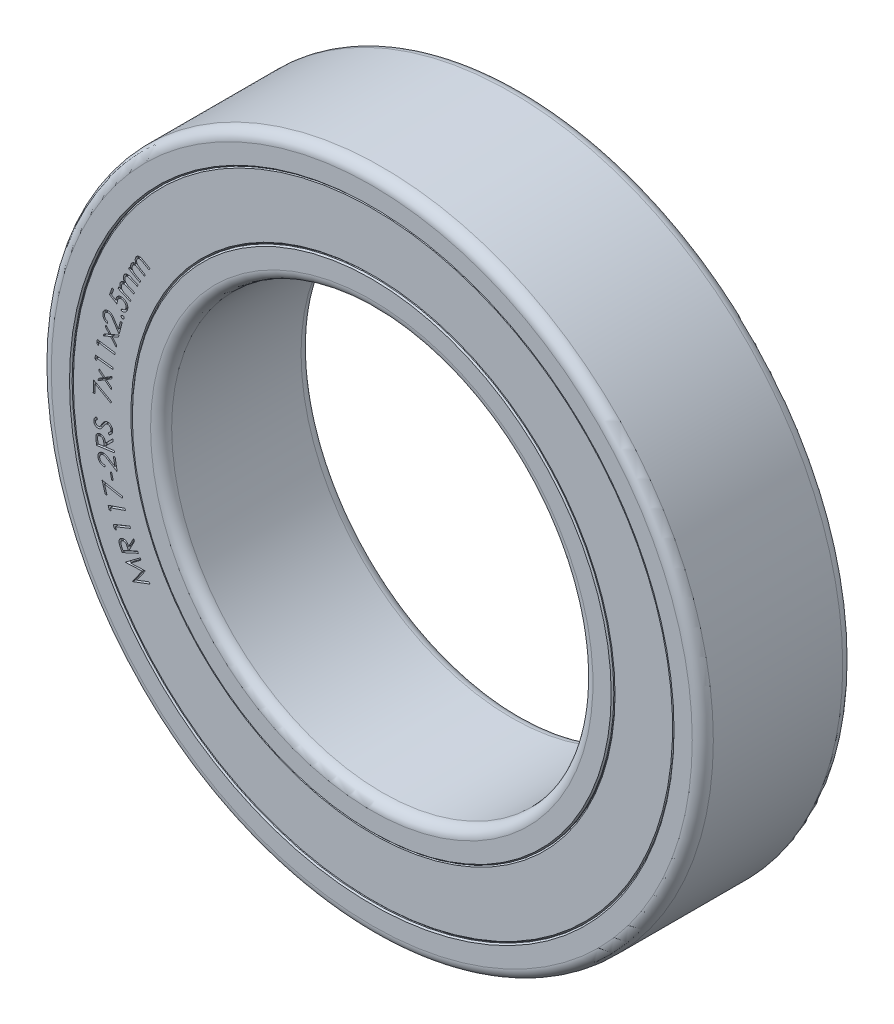
from build123d import *

# Parameters (mm, degrees)
SKETCH_R_INNER_BODY_W          = 2.5
SKETCH_R_INNER_BODY_H          = 0.5
FILLET_INNER_BODY_R            = 0.175
CHAMFER_INNER_BODY_SIZE        = 0.022
SKETCH_R_OUTER_BODY_W          = 2.5
SKETCH_R_OUTER_BODY_H          = 0.5
FILLET_OUTER_BODY_R            = 0.175
CHAMFER_OUTER_BODY_SIZE        = 0.022
SKETCH_R_SEAL_FACES_W          = 2.46
SKETCH_R_SEAL_FACES_H          = 1
CHAMFER_SEALS_SIZE             = 0.022
CUT_EXTRUDE_SEAL_LABEL_1_DEPTH = 0.05
CUT_EXTRUDE_SEAL_LABEL_2_DEPTH = 0.05


with BuildPart() as part:
    # Sketch R, INNER BODY → Revolve INNER BODY (revolve)
    with BuildSketch(Plane(origin=(0, 0, 0), x_dir=(0, 0, -1), z_dir=(1, 0, 0)), mode=Mode.PRIVATE) as revolve_inner_body_sk:
        with Locations((0, 3.75)):
            Rectangle(SKETCH_R_INNER_BODY_W, SKETCH_R_INNER_BODY_H)
    revolve(revolve_inner_body_sk.sketch.rotate(Axis((0, 0, 17.5), (0, 0, -1)), 90), axis=Axis((0, 0, 17.5), (0, 0, -1)))

    # Fillet INNER BODY
    fillet_inner_body_edges = [part.edges().sort_by_distance(p)[0] for p in [
        (-3.5, 0, -1.25),
        (-3.5, 0, 1.25),
    ]]
    fillet(fillet_inner_body_edges, radius=FILLET_INNER_BODY_R)

    # Chamfer INNER BODY
    chamfer_inner_body_edges = [part.edges().sort_by_distance(p)[0] for p in [
        (-4, 0, 1.25),
        (-4, 0, -1.25),
    ]]
    chamfer(chamfer_inner_body_edges, length=CHAMFER_INNER_BODY_SIZE)


with BuildPart() as body_2:
    # Sketch R, OUTER BODY → Revolve OUTER BODY (revolve)
    with BuildSketch(Plane(origin=(0, 0, 0), x_dir=(0, 0, -1), z_dir=(1, 0, 0)), mode=Mode.PRIVATE) as revolve_outer_body_sk:
        with Locations((0, 5.25)):
            Rectangle(SKETCH_R_OUTER_BODY_W, SKETCH_R_OUTER_BODY_H)
    revolve(revolve_outer_body_sk.sketch.rotate(Axis((0, 0, 17.5), (0, 0, -1)), 90), axis=Axis((0, 0, 17.5), (0, 0, -1)))

    # Fillet OUTER BODY
    fillet_outer_body_edges = [body_2.edges().sort_by_distance(p)[0] for p in [
        (-5.5, 0, 1.25),
        (-5.5, 0, -1.25),
    ]]
    fillet(fillet_outer_body_edges, radius=FILLET_OUTER_BODY_R)

    # Chamfer OUTER BODY
    chamfer_outer_body_edges = [body_2.edges().sort_by_distance(p)[0] for p in [
        (-5, 0, -1.25),
        (-5, 0, 1.25),
    ]]
    chamfer(chamfer_outer_body_edges, length=CHAMFER_OUTER_BODY_SIZE)


with BuildPart() as body_3:
    # Sketch R, SEAL FACES → Revolve SEALS (revolve)
    with BuildSketch(Plane(origin=(0, 0, 0), x_dir=(0, 0, -1), z_dir=(1, 0, 0)), mode=Mode.PRIVATE) as revolve_seals_sk:
        with Locations((0, 4.5)):
            Rectangle(SKETCH_R_SEAL_FACES_W, SKETCH_R_SEAL_FACES_H)
    revolve(revolve_seals_sk.sketch.rotate(Axis((0, 0, 17.5), (0, 0, -1)), 270), axis=Axis((0, 0, 17.5), (0, 0, -1)))

    # Chamfer SEALS
    chamfer_seals_edges = [body_3.edges().sort_by_distance(p)[0] for p in [
        (4, 0, -1.23),
        (4, 0, 1.23),
        (5, 0, 1.23),
        (5, 0, -1.23),
    ]]
    chamfer(chamfer_seals_edges, length=CHAMFER_SEALS_SIZE)

    # Sketch TEXT RADIUS 1 — MANUALLY ASSIGN TEXT AND FONT SIZE (FROM EQUATIONS) → Cut-Extrude SEAL LABEL 1 (cut)
    # profile 1 of 19: a face of its own
    with BuildSketch(Plane.XY.offset(1.23)):
        with BuildLine():
            Line((-4.061441007, 2.089873978), (-4.047378507, 2.114152824))
            Line((-4.047378507, 2.114152824), (-4.014566007, 2.095162439))
            add(Edge.make_bspline(
                [(-4.014566007, 2.095162439), (-4.016188044, 2.098925334), (-4.019295259, 2.10613363), (-4.022816428, 2.116852174), (-4.025097792, 2.126963929), (-4.025615491, 2.133534012), (-4.025864084, 2.136688881)],
                knots=[0, 0, 0, 0, 1.135394312, 2.174989403, 3.123653466, 4, 4, 4, 4], degree=3))
            add(Edge.make_bspline(
                [(-4.025864084, 2.136688881), (-4.025801514, 2.140765893), (-4.025678243, 2.148798178), (-4.023461942, 2.160532114), (-4.019929983, 2.171773433), (-4.016278426, 2.178663597), (-4.014445814, 2.182121574)],
                knots=[0, 0, 0, 0, 1.030349017, 2.029932119, 3.011279162, 4, 4, 4, 4], degree=3))
            add(Edge.make_bspline(
                [(-4.014445814, 2.182121574), (-4.013070617, 2.184357528), (-4.010335511, 2.188804578), (-4.005422762, 2.194863475), (-3.999978725, 2.200394199), (-3.993987244, 2.205266005), (-3.987703404, 2.209537009), (-3.981159455, 2.212893659), (-3.974558426, 2.21554646), (-3.967676984, 2.217337546), (-3.960305759, 2.21820648), (-3.952249215, 2.218320634), (-3.943404902, 2.217483078), (-3.937295327, 2.216401612), (-3.934097257, 2.215835516)],
                knots=[0, 0, 0, 0, 1.004896767, 1.998621936, 2.98098851, 3.973586636, 4.952829811, 5.886587582, 6.785958086, 7.673957255, 8.602178082, 9.623127228, 10.755820624, 12, 12, 12, 12], degree=3))
            add(Edge.make_bspline(
                [(-3.934097257, 2.215835516), (-3.936451176, 2.219968079), (-3.941043101, 2.228029706), (-3.945921816, 2.240737076), (-3.949234796, 2.253369368), (-3.950605186, 2.265942332), (-3.950242835, 2.278275945), (-3.948268892, 2.290194919), (-3.944622293, 2.301679356), (-3.940860714, 2.308734409), (-3.938965045, 2.312289843)],
                knots=[0, 0, 0, 0, 1.122618351, 2.189955994, 3.206182811, 4.201651633, 5.167892351, 6.11356966, 7.049322857, 8, 8, 8, 8], degree=3))
            add(Edge.make_bspline(
                [(-3.938965045, 2.312289843), (-3.936983854, 2.315413699), (-3.933107951, 2.321525052), (-3.925984355, 2.329558991), (-3.917914884, 2.336245743), (-3.908975549, 2.341539044), (-3.899402118, 2.345458016), (-3.889316101, 2.34792972), (-3.87878913, 2.348644969), (-3.869738301, 2.348050742), (-3.862172506, 2.346711635), (-3.856001899, 2.34509771), (-3.84940166, 2.343024356), (-3.842427746, 2.340237822), (-3.834958245, 2.337088262), (-3.827099322, 2.333292835), (-3.818868284, 2.328857331), (-3.813258779, 2.325700452), (-3.810359276, 2.324068689)],
                knots=[0, 0, 0, 0, 1.206389112, 2.360118525, 3.489032847, 4.615272259, 5.738811356, 6.855666866, 7.990421171, 9.170384434, 9.808073662, 10.496572007, 11.251606216, 12.065434025, 12.947476853, 13.898262832, 14.913630945, 16, 16, 16, 16], degree=3))
            Line((-3.810359276, 2.324068689), (-3.706633314, 2.263912439))
            Line((-3.706633314, 2.263912439), (-3.721116488, 2.238912439))
            Line((-3.721116488, 2.238912439), (-3.824842449, 2.299068689))
            add(Edge.make_bspline(
                [(-3.824842449, 2.299068689), (-3.827297957, 2.300486057), (-3.831996784, 2.303198313), (-3.838893015, 2.306862847), (-3.845234457, 2.310107388), (-3.851044521, 2.312905254), (-3.85637868, 2.31511865), (-3.861142332, 2.316969225), (-3.865453312, 2.318230085), (-3.87041557, 2.319375864), (-3.876324754, 2.319869552), (-3.88324194, 2.319319668), (-3.890050177, 2.317662038), (-3.896670849, 2.314959316), (-3.902946219, 2.311156084), (-3.908672554, 2.306288732), (-3.913896984, 2.300458031), (-3.916677936, 2.295932907), (-3.91811168, 2.293599939)],
                knots=[0, 0, 0, 0, 1.264359114, 2.419460172, 3.482255704, 4.441349932, 5.294197657, 6.057509921, 6.718980186, 7.295545236, 8.326820068, 9.348452973, 10.377713594, 11.439494811, 12.525799051, 13.635365706, 14.780891638, 16, 16, 16, 16], degree=3))
            add(Edge.make_bspline(
                [(-3.91811168, 2.293599939), (-3.919674564, 2.290618683), (-3.922776201, 2.284702205), (-3.92564119, 2.275073517), (-3.926966053, 2.26509778), (-3.92676369, 2.254911245), (-3.925117861, 2.244771527), (-3.921867471, 2.235008831), (-3.917248865, 2.225716988), (-3.912205114, 2.218381076), (-3.907173982, 2.212639362), (-3.902471302, 2.208103071), (-3.896903189, 2.203366673), (-3.890539135, 2.198378105), (-3.88329021, 2.193231941), (-3.875239817, 2.187801364), (-3.866268713, 2.182242304), (-3.859965904, 2.178523549), (-3.856693411, 2.176592728)],
                knots=[0, 0, 0, 0, 1.077300898, 2.137967267, 3.200809683, 4.292925484, 5.393246005, 6.481975451, 7.579292191, 8.710671029, 9.325188008, 10.024698931, 10.803604251, 11.668355432, 12.616644088, 13.653470445, 14.781653936, 16, 16, 16, 16], degree=3))
            Line((-3.856693411, 2.176592728), (-3.782294372, 2.133443689))
            Line((-3.782294372, 2.133443689), (-3.796356872, 2.109164843))
            Line((-3.796356872, 2.109164843), (-3.893652545, 2.165595131))
            add(Edge.make_bspline(
                [(-3.893652545, 2.165595131), (-3.896413438, 2.167163823), (-3.901715288, 2.170176241), (-3.909363166, 2.174391777), (-3.916448122, 2.178017618), (-3.922896155, 2.181131899), (-3.928734328, 2.183755321), (-3.933979814, 2.185786335), (-3.938583145, 2.187418471), (-3.943913206, 2.188680142), (-3.950118543, 2.189371445), (-3.957395019, 2.18920834), (-3.964476113, 2.187612568), (-3.971373019, 2.185053009), (-3.977833916, 2.181315962), (-3.98378506, 2.176547738), (-3.989036822, 2.170678538), (-3.991892644, 2.166160971), (-3.993352064, 2.163852343)],
                knots=[0, 0, 0, 0, 1.331903302, 2.557705397, 3.662492691, 4.669637442, 5.561143618, 6.345975165, 7.028832761, 7.607610532, 8.639407874, 9.639836024, 10.645086391, 11.66881263, 12.715149744, 13.760980705, 14.855786275, 16, 16, 16, 16], degree=3))
            add(Edge.make_bspline(
                [(-3.993352064, 2.163852343), (-3.994860285, 2.16099195), (-3.99785339, 2.155315419), (-4.000480494, 2.145960681), (-4.001926897, 2.136240714), (-4.001744589, 2.126172125), (-4.000224514, 2.116105442), (-3.997160847, 2.106340647), (-3.992747232, 2.096983098), (-3.987799277, 2.089626896), (-3.982943202, 2.083930578), (-3.978612226, 2.079465193), (-3.973498244, 2.074974201), (-3.967766513, 2.070293541), (-3.961272213, 2.065554318), (-3.954150697, 2.060614109), (-3.9462605, 2.055654374), (-3.940735545, 2.052381098), (-3.937883314, 2.050691285)],
                knots=[0, 0, 0, 0, 1.088360247, 2.159881751, 3.259206806, 4.394879914, 5.543991516, 6.683540413, 7.835531127, 9.024123751, 9.66199092, 10.359888818, 11.121073499, 11.957175, 12.856211253, 13.833067207, 14.881331586, 16, 16, 16, 16], degree=3))
            Line((-3.937883314, 2.050691285), (-3.857354468, 2.003996574))
            Line((-3.857354468, 2.003996574), (-3.871416968, 1.979717728))
            Line((-3.871416968, 1.979717728), (-4.061441007, 2.089873978))
        make_face()
    # profile 2 of 19: a face of its own
    with BuildSketch(Plane.XY.offset(1.23)):
        with BuildLine():
            Line((-4.235458471, 1.714250496), (-4.224400779, 1.740091842))
            Line((-4.224400779, 1.740091842), (-4.189424817, 1.7251279))
            add(Edge.make_bspline(
                [(-4.189424817, 1.7251279), (-4.191535688, 1.728657612), (-4.19557537, 1.735412602), (-4.200322339, 1.745707972), (-4.203912185, 1.755498399), (-4.205169069, 1.762025979), (-4.205770971, 1.765151938)],
                knots=[0, 0, 0, 0, 1.133481246, 2.169200984, 3.123258264, 4, 4, 4, 4], degree=3))
            add(Edge.make_bspline(
                [(-4.205770971, 1.765151938), (-4.206208909, 1.769214182), (-4.207071187, 1.777212537), (-4.20632326, 1.789169519), (-4.204117219, 1.800768823), (-4.201333668, 1.808073479), (-4.199941644, 1.811726458)],
                knots=[0, 0, 0, 0, 1.030393299, 2.028792887, 3.014221085, 4, 4, 4, 4], degree=3))
            add(Edge.make_bspline(
                [(-4.199941644, 1.811726458), (-4.198826055, 1.814114272), (-4.196613225, 1.818850627), (-4.192497788, 1.825492514), (-4.187708906, 1.831605545), (-4.182335435, 1.837147936), (-4.176543343, 1.842040673), (-4.170502112, 1.846238028), (-4.164228079, 1.849643525), (-4.157566301, 1.852227891), (-4.150343724, 1.854040976), (-4.142324372, 1.855102981), (-4.133429772, 1.855370138), (-4.127223792, 1.855005819), (-4.123980106, 1.8548154)],
                knots=[0, 0, 0, 0, 1.007430318, 1.998291281, 2.980762782, 3.972364067, 4.945559823, 5.876454463, 6.781480082, 7.669347882, 8.602226938, 9.622972145, 10.757596374, 12, 12, 12, 12], degree=3))
            add(Edge.make_bspline(
                [(-4.123980106, 1.8548154), (-4.126824681, 1.858656161), (-4.132355643, 1.866124099), (-4.138795118, 1.878155151), (-4.143604428, 1.890319818), (-4.146471706, 1.90269505), (-4.147661638, 1.915015078), (-4.146999724, 1.927118133), (-4.144892473, 1.938972173), (-4.142012712, 1.946438693), (-4.140566644, 1.950187996)],
                knots=[0, 0, 0, 0, 1.125901596, 2.18919175, 3.207796329, 4.202498747, 5.175157329, 6.116504733, 7.054205447, 8, 8, 8, 8], degree=3))
            add(Edge.make_bspline(
                [(-4.140566644, 1.950187996), (-4.138978703, 1.953546231), (-4.135875228, 1.960109573), (-4.129679568, 1.968919106), (-4.122507908, 1.976601143), (-4.114190139, 1.98290212), (-4.105146437, 1.987973746), (-4.09537524, 1.991586958), (-4.085008552, 1.993592298), (-4.075944749, 1.994091361), (-4.068267078, 1.993712478), (-4.061948636, 1.99282504), (-4.055151396, 1.991489566), (-4.047863721, 1.989687784), (-4.040103704, 1.987297362), (-4.031839002, 1.984492402), (-4.023090909, 1.981157333), (-4.01714287, 1.978689087), (-4.01406424, 1.977411554)],
                knots=[0, 0, 0, 0, 1.208859151, 2.362596997, 3.49415609, 4.621128718, 5.74929222, 6.862698405, 8.001018292, 9.17805672, 9.812213875, 10.503829415, 11.255462797, 12.069395394, 12.949290287, 13.901119616, 14.913646356, 16, 16, 16, 16], degree=3))
            Line((-4.01406424, 1.977411554), (-3.90360751, 1.930055784))
            Line((-3.90360751, 1.930055784), (-3.914965683, 1.903493284))
            Line((-3.914965683, 1.903493284), (-4.025422414, 1.950849054))
            add(Edge.make_bspline(
                [(-4.025422414, 1.950849054), (-4.028024304, 1.951935905), (-4.033032228, 1.954027794), (-4.040274756, 1.956956026), (-4.047019667, 1.959311474), (-4.053120164, 1.961417265), (-4.058692927, 1.962952919), (-4.063645521, 1.964214719), (-4.0680731, 1.964926853), (-4.073145915, 1.965439991), (-4.07905364, 1.965220338), (-4.085863933, 1.963866537), (-4.092441503, 1.961450217), (-4.09870963, 1.957945811), (-4.104480592, 1.953420863), (-4.109667237, 1.947944749), (-4.114081992, 1.941456175), (-4.116334414, 1.936621904), (-4.117489721, 1.934142323)],
                knots=[0, 0, 0, 0, 1.256454401, 2.418329707, 3.479841587, 4.439502159, 5.292821979, 6.054853104, 6.715168554, 7.288913525, 8.324901637, 9.334918272, 10.371252374, 11.434114301, 12.521466702, 13.626407416, 14.782543165, 16, 16, 16, 16], degree=3))
            add(Edge.make_bspline(
                [(-4.117489721, 1.934142323), (-4.11867047, 1.930966959), (-4.121001961, 1.92469693), (-4.122759378, 1.914783732), (-4.122830726, 1.904709195), (-4.121461511, 1.894580624), (-4.118580491, 1.884700276), (-4.114288928, 1.875312299), (-4.108471132, 1.866687196), (-4.102589886, 1.859959908), (-4.096855925, 1.854905382), (-4.091651125, 1.850938236), (-4.085577957, 1.846852542), (-4.078564063, 1.842756528), (-4.070778675, 1.838412086), (-4.062095584, 1.834027633), (-4.052508387, 1.829600357), (-4.045800198, 1.826658674), (-4.042309433, 1.8251279)],
                knots=[0, 0, 0, 0, 1.082187489, 2.136872141, 3.200764801, 4.293789728, 5.395031245, 6.48178211, 7.581997576, 8.712389771, 9.329740825, 10.024467697, 10.804756827, 11.669718044, 12.622069116, 13.656703889, 14.780610414, 16, 16, 16, 16], degree=3))
            Line((-4.042309433, 1.8251279), (-3.963102702, 1.791173573))
            Line((-3.963102702, 1.791173573), (-3.974160394, 1.765332227))
            Line((-3.974160394, 1.765332227), (-4.077706067, 1.809683188))
            add(Edge.make_bspline(
                [(-4.077706067, 1.809683188), (-4.080645289, 1.810938365), (-4.086280333, 1.813344776), (-4.094438685, 1.816583395), (-4.101917355, 1.819355062), (-4.108696154, 1.821722111), (-4.114826136, 1.823607597), (-4.120306637, 1.824984888), (-4.1250919, 1.825995583), (-4.130529537, 1.82663036), (-4.136792729, 1.826672876), (-4.143968226, 1.825425938), (-4.150869715, 1.823115173), (-4.157394933, 1.819681433), (-4.163437241, 1.815244065), (-4.168715442, 1.809745707), (-4.173233108, 1.803291405), (-4.175512364, 1.798463785), (-4.176684433, 1.795981265)],
                knots=[0, 0, 0, 0, 1.337302711, 2.56386287, 3.672475879, 4.674495789, 5.568099485, 6.354870208, 7.038729721, 7.612653261, 8.643669125, 9.646880372, 10.646197001, 11.677246939, 12.720019505, 13.769274093, 14.8528877, 16, 16, 16, 16], degree=3))
            add(Edge.make_bspline(
                [(-4.176684433, 1.795981265), (-4.177832844, 1.792967069), (-4.180127104, 1.786945399), (-4.181656316, 1.777330947), (-4.181863232, 1.767474674), (-4.180509657, 1.757494754), (-4.177777163, 1.747668569), (-4.173583878, 1.738307968), (-4.167970947, 1.72958496), (-4.162209916, 1.722827829), (-4.156690162, 1.71773583), (-4.151814105, 1.713836467), (-4.146205318, 1.709935556), (-4.139874338, 1.706060755), (-4.132884991, 1.702081757), (-4.125193929, 1.698061059), (-4.116774911, 1.69403253), (-4.110867955, 1.691474409), (-4.10781424, 1.690151938)],
                knots=[0, 0, 0, 0, 1.083575306, 2.164733719, 3.257610989, 4.393758059, 5.542627714, 6.680855129, 7.833441154, 9.02448279, 9.65926573, 10.359772169, 11.12508444, 11.958030437, 12.858228901, 13.83271211, 14.879578628, 16, 16, 16, 16], degree=3))
            Line((-4.10781424, 1.690151938), (-4.022117125, 1.653433188))
            Line((-4.022117125, 1.653433188), (-4.033174817, 1.627591842))
            Line((-4.033174817, 1.627591842), (-4.235458471, 1.714250496))
        make_face()
    # profile 3 of 19: a face of its own
    with BuildSketch(Plane.XY.offset(1.23)):
        with BuildLine():
            Line((-4.333079779, 1.675944203), (-4.306517279, 1.666088434))
            Line((-4.306517279, 1.666088434), (-4.343296125, 1.566689395))
            Line((-4.343296125, 1.566689395), (-4.272322568, 1.52474228))
            add(Edge.make_bspline(
                [(-4.272322568, 1.52474228), (-4.272043501, 1.527992493), (-4.271502327, 1.534295399), (-4.270037773, 1.543363927), (-4.268199107, 1.551773126), (-4.266400903, 1.557007705), (-4.265531702, 1.559537953)],
                knots=[0, 0, 0, 0, 1.100341103, 2.133813278, 3.09793806, 4, 4, 4, 4], degree=3))
            add(Edge.make_bspline(
                [(-4.265531702, 1.559537953), (-4.264310126, 1.562630144), (-4.2619122, 1.56870004), (-4.257345559, 1.577185199), (-4.252242676, 1.585005473), (-4.246440795, 1.592079381), (-4.239981776, 1.598413027), (-4.232884096, 1.604037913), (-4.225180529, 1.609006353), (-4.216824643, 1.613094429), (-4.208130673, 1.616469108), (-4.199161566, 1.618875929), (-4.190046127, 1.620403653), (-4.180758319, 1.620940135), (-4.171320094, 1.620490014), (-4.161724584, 1.619156818), (-4.151955952, 1.616891241), (-4.145541151, 1.6146471), (-4.142274491, 1.613504299)],
                knots=[0, 0, 0, 0, 1.056900497, 2.074670051, 3.059175435, 4.023655878, 4.979018983, 5.931487043, 6.900232005, 7.889182503, 8.885701245, 9.8627116, 10.838099462, 11.821180643, 12.816333187, 13.839257146, 14.899667771, 16, 16, 16, 16], degree=3))
            add(Edge.make_bspline(
                [(-4.142274491, 1.613504299), (-4.140018311, 1.612632679), (-4.135546503, 1.610905106), (-4.129095642, 1.607803031), (-4.122922734, 1.604381432), (-4.117007362, 1.600678287), (-4.111453903, 1.596542657), (-4.106154745, 1.592089059), (-4.101121469, 1.587306806), (-4.096420801, 1.582188431), (-4.092133762, 1.576805981), (-4.08821654, 1.571270717), (-4.08468828, 1.565589297), (-4.081641778, 1.559720961), (-4.079035601, 1.553699667), (-4.07695337, 1.54751356), (-4.075166447, 1.54121015), (-4.073940217, 1.534710495), (-4.07308297, 1.528130418), (-4.072716449, 1.521460584), (-4.072868421, 1.514737405), (-4.073365234, 1.507901933), (-4.074513086, 1.50103595), (-4.075912635, 1.494051495), (-4.077923222, 1.487041609), (-4.079551361, 1.482386799), (-4.080375452, 1.480030741)],
                knots=[0, 0, 0, 0, 1.055470154, 2.091970013, 3.121363376, 4.135414699, 5.135800982, 6.141219345, 7.155572244, 8.164369281, 9.172218396, 10.157237796, 11.123090724, 12.089141553, 13.04099905, 13.983978592, 14.93651867, 15.898603755, 16.868249314, 17.831565526, 18.811096877, 19.802345619, 20.820197789, 21.847471947, 22.910485781, 24, 24, 24, 24], degree=3))
            add(Edge.make_bspline(
                [(-4.080375452, 1.480030741), (-4.081474606, 1.477287546), (-4.083637177, 1.471890345), (-4.087571414, 1.464225841), (-4.092009434, 1.457109755), (-4.09701321, 1.450580376), (-4.102583352, 1.444679435), (-4.108620369, 1.439289544), (-4.115189412, 1.434462269), (-4.122266303, 1.430278377), (-4.129678628, 1.426768246), (-4.137281423, 1.423885111), (-4.145089645, 1.421880889), (-4.153040412, 1.420441415), (-4.161195344, 1.419897974), (-4.169497339, 1.419921266), (-4.177966055, 1.420774569), (-4.183588353, 1.421891228), (-4.186445164, 1.422458626)],
                knots=[0, 0, 0, 0, 1.070052649, 2.105314774, 3.116024176, 4.104423666, 5.079818569, 6.051237495, 7.032364918, 8.027956917, 9.02442121, 10.000274874, 10.968327218, 11.940613047, 12.922920485, 13.92433972, 14.945312499, 16, 16, 16, 16], degree=3))
            Line((-4.186445164, 1.422458626), (-4.175868241, 1.451124491))
            add(Edge.make_bspline(
                [(-4.175868241, 1.451124491), (-4.173068857, 1.450753434), (-4.167686168, 1.45003996), (-4.159805864, 1.449818512), (-4.152478196, 1.45053322), (-4.145641549, 1.452093953), (-4.139218398, 1.454573989), (-4.133093282, 1.457804857), (-4.127253236, 1.461921054), (-4.121742117, 1.466739027), (-4.116634754, 1.472157068), (-4.112248779, 1.478144978), (-4.108513276, 1.484537824), (-4.106663957, 1.489099842), (-4.105736029, 1.491388914)],
                knots=[0, 0, 0, 0, 1.151329697, 2.213790183, 3.207282446, 4.146723538, 5.064780267, 6.00776777, 6.964286206, 7.971956445, 8.989384513, 9.994401238, 10.993655644, 12, 12, 12, 12], degree=3))
            add(Edge.make_bspline(
                [(-4.105736029, 1.491388914), (-4.104967269, 1.493658807), (-4.10344307, 1.498159262), (-4.102015078, 1.505074993), (-4.101349251, 1.511986029), (-4.101412133, 1.518874528), (-4.102191263, 1.525788417), (-4.103772264, 1.532691176), (-4.106085704, 1.539585869), (-4.109067865, 1.546392246), (-4.112707283, 1.552952153), (-4.116908209, 1.559110821), (-4.121720213, 1.564752083), (-4.127058534, 1.569921735), (-4.132978014, 1.574578514), (-4.139480405, 1.578644593), (-4.146449151, 1.582387554), (-4.151445855, 1.584329284), (-4.153993241, 1.585319203)],
                knots=[0, 0, 0, 0, 0.977452859, 1.937968841, 2.874379991, 3.806497953, 4.744620878, 5.708610457, 6.69111126, 7.708903467, 8.737313448, 9.748780629, 10.746473034, 11.75836972, 12.777376301, 13.813944282, 14.885520275, 16, 16, 16, 16], degree=3))
            add(Edge.make_bspline(
                [(-4.153993241, 1.585319203), (-4.156302727, 1.586128705), (-4.160842934, 1.5877201), (-4.167763814, 1.589237448), (-4.174537397, 1.590175566), (-4.181200546, 1.59041164), (-4.18775274, 1.590022161), (-4.194172308, 1.588843704), (-4.200467761, 1.587047695), (-4.206561423, 1.584519723), (-4.212388023, 1.581383894), (-4.217895333, 1.577743678), (-4.222916021, 1.573402959), (-4.227544128, 1.56853096), (-4.231785126, 1.563083802), (-4.235549499, 1.557045977), (-4.23896171, 1.55046513), (-4.240794698, 1.545774704), (-4.241733625, 1.543372087)],
                knots=[0, 0, 0, 0, 1.071605255, 2.106663339, 3.09868269, 4.065003501, 5.023878338, 5.969276011, 6.919511796, 7.887904037, 8.854105206, 9.815869194, 10.774744032, 11.755865818, 12.756818105, 13.794404716, 14.870209053, 16, 16, 16, 16], degree=3))
            add(Edge.make_bspline(
                [(-4.241733625, 1.543372087), (-4.242467506, 1.541238461), (-4.24397452, 1.536857092), (-4.245659402, 1.529909383), (-4.247128804, 1.52249662), (-4.248184774, 1.514567609), (-4.248899885, 1.506144739), (-4.249250496, 1.497241814), (-4.249238472, 1.487840353), (-4.249005068, 1.481412459), (-4.248885068, 1.478107664)],
                knots=[0, 0, 0, 0, 0.81917917, 1.682172334, 2.594059324, 3.563445359, 4.58588957, 5.663694983, 6.798827717, 8, 8, 8, 8], degree=3))
            Line((-4.248885068, 1.478107664), (-4.377791318, 1.555150934))
            Line((-4.377791318, 1.555150934), (-4.333079779, 1.675944203))
        make_face()
    # profile 4 of 19: a face of its own
    with BuildSketch(Plane.XY.offset(1.23)):
        with BuildLine():
            add(Edge.make_bspline(
                [(-4.183181318, 1.345636427), (-4.182581262, 1.347208265), (-4.181409029, 1.350278909), (-4.178624756, 1.35434881), (-4.175046391, 1.357692412), (-4.170878154, 1.360376594), (-4.166250799, 1.362249981), (-4.161411487, 1.363169554), (-4.156421853, 1.363072942), (-4.153220866, 1.362194854), (-4.151570741, 1.361742196)],
                knots=[0, 0, 0, 0, 1.021045161, 1.994649816, 2.968864594, 3.983121931, 4.994812917, 5.986857547, 6.962215279, 8, 8, 8, 8], degree=3))
            add(Edge.make_bspline(
                [(-4.151570741, 1.361742196), (-4.149995859, 1.361167558), (-4.146912266, 1.360042427), (-4.142862843, 1.357221112), (-4.13942868, 1.353685191), (-4.136781859, 1.349418665), (-4.134871111, 1.344811441), (-4.133826582, 1.33998085), (-4.133961323, 1.33504641), (-4.134800173, 1.331862637), (-4.135224587, 1.330251811)],
                knots=[0, 0, 0, 0, 1.017069628, 1.991406062, 2.974785785, 4.000086799, 5.028430472, 5.999631648, 6.987916038, 8, 8, 8, 8], degree=3))
            add(Edge.make_bspline(
                [(-4.135224587, 1.330251811), (-4.135790627, 1.328670776), (-4.136897223, 1.325579889), (-4.139836093, 1.321621244), (-4.143318629, 1.318158021), (-4.147617894, 1.315595168), (-4.152229237, 1.313685451), (-4.15710101, 1.312873039), (-4.162039268, 1.312850514), (-4.165223782, 1.313710755), (-4.166835164, 1.314146042)],
                knots=[0, 0, 0, 0, 1.017951187, 1.990070823, 2.974302904, 3.994009433, 5.018673101, 5.998123828, 6.987038799, 8, 8, 8, 8], degree=3))
            add(Edge.make_bspline(
                [(-4.166835164, 1.314146042), (-4.168430221, 1.314741109), (-4.17155588, 1.315907198), (-4.175642676, 1.318769253), (-4.179078265, 1.322316226), (-4.181745395, 1.326513778), (-4.183646043, 1.331110409), (-4.184452077, 1.335942117), (-4.184472905, 1.340860205), (-4.183617045, 1.34402513), (-4.183181318, 1.345636427)],
                knots=[0, 0, 0, 0, 1.032812194, 2.023889091, 3.007056831, 4.0218577, 5.034090841, 6.012482398, 6.988134209, 8, 8, 8, 8], degree=3))
        make_face()
    # profile 5 of 19: a face of its own
    with BuildSketch(Plane.XY.offset(1.23)):
        with BuildLine():
            Line((-4.406467062, 1.148331668), (-4.4136786, 1.12080763))
            add(Edge.make_bspline(
                [(-4.4136786, 1.12080763), (-4.417104085, 1.121893315), (-4.423833344, 1.124026109), (-4.433417744, 1.128131084), (-4.442305416, 1.132938588), (-4.450454714, 1.138509208), (-4.457940269, 1.144724474), (-4.464789257, 1.151590742), (-4.470854631, 1.159224861), (-4.476261667, 1.167412988), (-4.480776044, 1.176065083), (-4.484443431, 1.184965025), (-4.487088566, 1.194073477), (-4.488784267, 1.203357511), (-4.489485344, 1.212802524), (-4.48932075, 1.222423798), (-4.48812555, 1.232233869), (-4.486578387, 1.238728723), (-4.485793985, 1.242021572)],
                knots=[0, 0, 0, 0, 1.097083054, 2.155185397, 3.179196285, 4.178786333, 5.165104729, 6.147238955, 7.13530184, 8.138257017, 9.139942252, 10.11142162, 11.07376328, 12.031483849, 12.988813432, 13.961852297, 14.96667212, 16, 16, 16, 16], degree=3))
            add(Edge.make_bspline(
                [(-4.485793985, 1.242021572), (-4.484869722, 1.245225824), (-4.483058301, 1.25150569), (-4.479423564, 1.260415612), (-4.475159529, 1.268673753), (-4.470129315, 1.276186593), (-4.464545457, 1.283118729), (-4.458167303, 1.289285113), (-4.451109381, 1.294743934), (-4.443505881, 1.299543712), (-4.435512691, 1.303519661), (-4.427345013, 1.306725081), (-4.419093802, 1.309180551), (-4.41072601, 1.310657911), (-4.402292331, 1.311340248), (-4.39377955, 1.311136628), (-4.38515648, 1.310147965), (-4.379473085, 1.308805938), (-4.376599273, 1.308127341)],
                knots=[0, 0, 0, 0, 1.122314766, 2.199573676, 3.234457262, 4.246601194, 5.239019439, 6.226473493, 7.226314566, 8.238795613, 9.249387366, 10.227698238, 11.190420022, 12.143093011, 13.083652815, 14.034987511, 15.006390376, 16, 16, 16, 16], degree=3))
            add(Edge.make_bspline(
                [(-4.376599273, 1.308127341), (-4.372616956, 1.306924553), (-4.364727477, 1.304541675), (-4.353558601, 1.29922764), (-4.343226346, 1.292477256), (-4.335173309, 1.285737743), (-4.328909072, 1.279447897), (-4.32391502, 1.273859061), (-4.318584646, 1.267521041), (-4.312992144, 1.260330409), (-4.307109445, 1.252328952), (-4.300934405, 1.243514822), (-4.294515636, 1.233862884), (-4.290154993, 1.227161673), (-4.28789735, 1.223692245)],
                knots=[0, 0, 0, 0, 1.19049762, 2.358527445, 3.52848712, 4.718099159, 5.359256712, 6.07033808, 6.864641483, 7.731374452, 8.679461713, 9.709544103, 10.814159059, 12, 12, 12, 12], degree=3))
            Line((-4.28789735, 1.223692245), (-4.229543985, 1.131925418))
            Line((-4.229543985, 1.131925418), (-4.194748312, 1.26455763))
            Line((-4.194748312, 1.26455763), (-4.166983889, 1.257285995))
            Line((-4.166983889, 1.257285995), (-4.218185812, 1.062153784))
            Line((-4.218185812, 1.062153784), (-4.307969466, 1.203079265))
            add(Edge.make_bspline(
                [(-4.307969466, 1.203079265), (-4.310140511, 1.206512767), (-4.314312913, 1.213111409), (-4.320509844, 1.222470439), (-4.326285768, 1.230974205), (-4.331649843, 1.238587311), (-4.336692608, 1.245294319), (-4.341243403, 1.25119059), (-4.345543378, 1.256122412), (-4.350599402, 1.261553938), (-4.356959865, 1.267279375), (-4.365236253, 1.272747355), (-4.373974296, 1.277219075), (-4.380209324, 1.27907395), (-4.383330043, 1.280002341)],
                knots=[0, 0, 0, 0, 1.324406492, 2.545296977, 3.659356239, 4.675960514, 5.581167442, 6.395143925, 7.103546535, 7.713423779, 8.814446353, 9.883169328, 10.940496546, 12, 12, 12, 12], degree=3))
            add(Edge.make_bspline(
                [(-4.383330043, 1.280002341), (-4.385325753, 1.280464007), (-4.389266942, 1.281375717), (-4.395272508, 1.282019831), (-4.401210243, 1.282086603), (-4.407096825, 1.281554376), (-4.412905044, 1.280345711), (-4.418614593, 1.278433954), (-4.424315235, 1.276044714), (-4.429829527, 1.272987453), (-4.435102982, 1.269458345), (-4.43999759, 1.265518615), (-4.44432201, 1.261067109), (-4.448264177, 1.256344626), (-4.45165471, 1.251146108), (-4.454599283, 1.245584848), (-4.457005103, 1.239586901), (-4.458242717, 1.235421774), (-4.458870908, 1.23330763)],
                knots=[0, 0, 0, 0, 0.994801955, 1.964564024, 2.92844394, 3.876859539, 4.831550497, 5.804435173, 6.798998904, 7.831622021, 8.863097141, 9.880322637, 10.878548722, 11.874540945, 12.865524435, 13.888927518, 14.928457584, 16, 16, 16, 16], degree=3))
            add(Edge.make_bspline(
                [(-4.458870908, 1.23330763), (-4.459422112, 1.23103341), (-4.46050114, 1.226581434), (-4.461239151, 1.219844435), (-4.461430863, 1.21329232), (-4.461051465, 1.206858265), (-4.459859257, 1.20058747), (-4.458128218, 1.194417894), (-4.455714566, 1.18839207), (-4.452628819, 1.182569221), (-4.448982725, 1.176951054), (-4.444638188, 1.171737807), (-4.439705152, 1.166895045), (-4.434245796, 1.162365994), (-4.428130861, 1.158303782), (-4.421474722, 1.154542432), (-4.414208971, 1.151191358), (-4.409084998, 1.149298676), (-4.406467062, 1.148331668)],
                knots=[0, 0, 0, 0, 1.009725518, 1.976622166, 2.920008896, 3.83908107, 4.753744806, 5.671186695, 6.602997689, 7.55113304, 8.513373658, 9.490397171, 10.47535603, 11.495590396, 12.548997363, 13.641437074, 14.79496489, 16, 16, 16, 16], degree=3))
        make_face()
    # profile 6 of 19: a face of its own
    with BuildSketch(Plane.XY.offset(1.23)):
        Polygon((-4.478249237, 0.910039414), (-4.470737218, 0.943152395), (-4.37836943, 0.981854318), (-4.444955968, 1.056734126), (-4.437443949, 1.089907202), (-4.352167506, 0.993392779), (-4.220797314, 1.050424029), (-4.22836943, 1.016890376), (-4.333417506, 0.971698068), (-4.257996833, 0.886541818), (-4.265448756, 0.853609126), (-4.35961943, 0.960460087), align=None)
    # profile 7 of 19: a face of its own
    with BuildSketch(Plane.XY.offset(1.23)):
        Polygon((-4.58811884, 0.750234768), (-4.579044321, 0.808347749), (-4.28343134, 0.762013614), (-4.288058744, 0.732626595), (-4.554705378, 0.774393422), (-4.561977013, 0.727999191), align=None)
    # profile 8 of 19: a face of its own
    with BuildSketch(Plane.XY.offset(1.23)):
        Polygon((-4.618186903, 0.510509494), (-4.611275846, 0.568622475), (-4.315662865, 0.533406129), (-4.319148442, 0.50401911), (-4.585795076, 0.535809975), (-4.591323923, 0.489415744), align=None)
    # profile 9 of 19: a face of its own
    with BuildSketch(Plane.XY.offset(1.23)):
        Polygon((-4.565670799, 0.221111437), (-4.563327049, 0.255185957), (-4.477629934, 0.308070572), (-4.555334261, 0.37201288), (-4.553050607, 0.406087399), (-4.453290992, 0.323515284), (-4.331716472, 0.400618649), (-4.334060222, 0.366123457), (-4.431355895, 0.304885476), (-4.343194838, 0.232048937), (-4.345538588, 0.198154707), (-4.455634742, 0.289621053), align=None)
    # profile 10 of 19: a face of its own
    with BuildSketch(Plane.XY.offset(1.23)):
        Polygon((-4.647488107, 0.006900691), (-4.642560222, 0.19614348), (-4.340817434, 0.028595403), (-4.354038587, 0.004376653), (-4.615577049, 0.149208383), (-4.61930301, 0.006179537), align=None)
    # profile 11 of 19: a face of its own
    with BuildSketch(Plane.XY.offset(1.23)):
        with BuildLine():
            Line((-4.380822628, -0.467206158), (-4.39813032, -0.4431076))
            add(Edge.make_bspline(
                [(-4.39813032, -0.4431076), (-4.394420034, -0.440563934), (-4.387319424, -0.435695958), (-4.37783312, -0.427758751), (-4.369934369, -0.41966452), (-4.363529692, -0.411480265), (-4.358670949, -0.4031038), (-4.355429538, -0.394566648), (-4.353761582, -0.385840431), (-4.353933562, -0.380032459), (-4.354019743, -0.377122023)],
                knots=[0, 0, 0, 0, 1.294629125, 2.47761414, 3.554367602, 4.545297737, 5.462381453, 6.33113132, 7.163712061, 8, 8, 8, 8], degree=3))
            add(Edge.make_bspline(
                [(-4.354019743, -0.377122023), (-4.354328297, -0.374669723), (-4.354942111, -0.369791304), (-4.356783246, -0.362646474), (-4.359690055, -0.355891726), (-4.363250658, -0.349471656), (-4.367539894, -0.343644484), (-4.372375965, -0.338492082), (-4.377831189, -0.334272759), (-4.383733395, -0.330908751), (-4.389943381, -0.328385672), (-4.396315934, -0.326668114), (-4.402843052, -0.325927898), (-4.407184219, -0.326122616), (-4.409368301, -0.326220581)],
                knots=[0, 0, 0, 0, 1.063480137, 2.11560613, 3.163056614, 4.220962789, 5.269655022, 6.27000351, 7.253255891, 8.226626088, 9.185873944, 10.13133918, 11.05985915, 12, 12, 12, 12], degree=3))
            add(Edge.make_bspline(
                [(-4.409368301, -0.326220581), (-4.411853235, -0.326551768), (-4.416870061, -0.327220402), (-4.424148919, -0.329916021), (-4.431351367, -0.333595545), (-4.435682802, -0.337017822), (-4.437913974, -0.338780677)],
                knots=[0, 0, 0, 0, 0.947420206, 1.912743437, 2.924829884, 4, 4, 4, 4], degree=3))
            add(Edge.make_bspline(
                [(-4.437913974, -0.338780677), (-4.439540224, -0.340177803), (-4.442951234, -0.343108232), (-4.447829638, -0.348244786), (-4.453027092, -0.353996771), (-4.458344814, -0.360563651), (-4.463861899, -0.367862814), (-4.469659, -0.375832673), (-4.475512213, -0.384643287), (-4.479449116, -0.39077837), (-4.481483685, -0.393948946)],
                knots=[0, 0, 0, 0, 0.728942601, 1.528935161, 2.407294656, 3.366288606, 4.40218024, 5.520015585, 6.718358416, 8, 8, 8, 8], degree=3))
            add(Edge.make_bspline(
                [(-4.481483685, -0.393948946), (-4.483498044, -0.397099749), (-4.487349931, -0.403124766), (-4.493002304, -0.411657389), (-4.49820219, -0.419291459), (-4.50303758, -0.425999521), (-4.507421372, -0.431792054), (-4.511434779, -0.436659211), (-4.514965703, -0.440632335), (-4.517326933, -0.442841125), (-4.518382724, -0.443828754)],
                knots=[0, 0, 0, 0, 1.443239105, 2.759784673, 3.949910128, 5.007704904, 5.950921245, 6.752714306, 7.442293713, 8, 8, 8, 8], degree=3))
            add(Edge.make_bspline(
                [(-4.518382724, -0.443828754), (-4.520023431, -0.445238666), (-4.523266873, -0.44802586), (-4.528467236, -0.451683731), (-4.53379627, -0.45489023), (-4.539313523, -0.457519448), (-4.544918509, -0.459779478), (-4.550686058, -0.461527585), (-4.556627388, -0.46273102), (-4.560646156, -0.463189035), (-4.562673589, -0.4634201)],
                knots=[0, 0, 0, 0, 1.052685822, 2.081008974, 3.091274822, 4.077094557, 5.053266508, 6.031336729, 7.006826349, 8, 8, 8, 8], degree=3))
            add(Edge.make_bspline(
                [(-4.562673589, -0.4634201), (-4.565859024, -0.463584801), (-4.57214535, -0.463909833), (-4.581481136, -0.462924461), (-4.590453358, -0.460646103), (-4.599048348, -0.457317618), (-4.607088684, -0.452789864), (-4.614360924, -0.447152978), (-4.620968301, -0.440599085), (-4.626607163, -0.433033902), (-4.631372377, -0.42474713), (-4.635019656, -0.415896321), (-4.637648951, -0.406578108), (-4.638382762, -0.40015479), (-4.63875532, -0.396893658)],
                knots=[0, 0, 0, 0, 1.017219495, 2.007440875, 2.983118508, 3.96531438, 4.94185106, 5.917884975, 6.894714815, 7.903941113, 8.920919313, 9.938802074, 10.95352542, 12, 12, 12, 12], degree=3))
            add(Edge.make_bspline(
                [(-4.63875532, -0.396893658), (-4.638938466, -0.393405981), (-4.639300569, -0.386510408), (-4.638034781, -0.376230019), (-4.635662238, -0.366178236), (-4.632487278, -0.358008852), (-4.629141517, -0.35155828), (-4.626065945, -0.346593239), (-4.622478554, -0.341493635), (-4.618349814, -0.33629254), (-4.613610891, -0.330999436), (-4.60841208, -0.325555452), (-4.60267543, -0.319983088), (-4.598567091, -0.316367228), (-4.596447628, -0.314501831)],
                knots=[0, 0, 0, 0, 1.299098027, 2.568479367, 3.842985471, 5.140388401, 5.821424401, 6.548552714, 7.314742642, 8.14356124, 9.021284554, 9.960991814, 10.948090191, 12, 12, 12, 12], degree=3))
            Line((-4.596447628, -0.314501831), (-4.575954839, -0.337278273))
            add(Edge.make_bspline(
                [(-4.575954839, -0.337278273), (-4.577627842, -0.338789596), (-4.580856739, -0.341706452), (-4.585368928, -0.346113872), (-4.589437599, -0.350300669), (-4.59310016, -0.354263982), (-4.596192376, -0.358121296), (-4.598911174, -0.361705338), (-4.601194287, -0.36508774), (-4.603464812, -0.369374386), (-4.605658727, -0.374693289), (-4.607354853, -0.381262229), (-4.608177694, -0.388041185), (-4.607970516, -0.392605585), (-4.607865897, -0.394910484)],
                knots=[0, 0, 0, 0, 1.18185489, 2.28098202, 3.305857854, 4.242576029, 5.108572287, 5.896203327, 6.601073214, 7.24477121, 8.436337784, 9.608024076, 10.792116447, 12, 12, 12, 12], degree=3))
            add(Edge.make_bspline(
                [(-4.607865897, -0.394910484), (-4.607513545, -0.397797254), (-4.606833414, -0.403369468), (-4.604064538, -0.411162813), (-4.599953198, -0.417970068), (-4.594671924, -0.42374697), (-4.58843968, -0.428255187), (-4.581546246, -0.431329191), (-4.574128379, -0.432984633), (-4.56905099, -0.43280344), (-4.566459647, -0.432710965)],
                knots=[0, 0, 0, 0, 1.110825306, 2.144181127, 3.138550138, 4.137345803, 5.120740448, 6.061427978, 7.010612354, 8, 8, 8, 8], degree=3))
            add(Edge.make_bspline(
                [(-4.566459647, -0.432710965), (-4.564851261, -0.432525305), (-4.561643889, -0.432155069), (-4.556934349, -0.430978237), (-4.552333535, -0.429356792), (-4.547788041, -0.427165198), (-4.543296396, -0.424179026), (-4.538635095, -0.420521508), (-4.533962346, -0.415878455), (-4.530921278, -0.412417629), (-4.529320224, -0.410595581)],
                knots=[0, 0, 0, 0, 0.872525701, 1.739952009, 2.611406633, 3.50056599, 4.453605547, 5.515019482, 6.691713303, 8, 8, 8, 8], degree=3))
            add(Edge.make_bspline(
                [(-4.529320224, -0.410595581), (-4.528795119, -0.409917715), (-4.527548372, -0.408308272), (-4.52548914, -0.405390876), (-4.523024145, -0.401518613), (-4.51986412, -0.396893618), (-4.516322077, -0.391295504), (-4.512254358, -0.384846075), (-4.507679798, -0.37748618), (-4.504459971, -0.372294584), (-4.502757724, -0.369549908)],
                knots=[0, 0, 0, 0, 0.420761267, 0.999005179, 1.751531731, 2.673079907, 3.747480147, 5.002084818, 6.415071857, 8, 8, 8, 8], degree=3))
            add(Edge.make_bspline(
                [(-4.502757724, -0.369549908), (-4.50069782, -0.366229588), (-4.496698728, -0.359783529), (-4.490515586, -0.350682698), (-4.484472785, -0.342369314), (-4.47868264, -0.334746324), (-4.472905939, -0.327982398), (-4.467326852, -0.321932063), (-4.46186339, -0.316672764), (-4.454824926, -0.310842654), (-4.446044479, -0.304758408), (-4.435122268, -0.299332858), (-4.424068375, -0.295426549), (-4.416488355, -0.294478598), (-4.412733685, -0.294009042)],
                knots=[0, 0, 0, 0, 1.152627555, 2.237707498, 3.244850755, 4.184562195, 5.060808643, 5.867840744, 6.611848852, 7.295865724, 8.562934787, 9.752232399, 10.886596087, 12, 12, 12, 12], degree=3))
            add(Edge.make_bspline(
                [(-4.412733685, -0.294009042), (-4.410070174, -0.293854379), (-4.404800148, -0.293548364), (-4.39693756, -0.294045978), (-4.389285783, -0.295374323), (-4.381834863, -0.297496703), (-4.374589362, -0.300404162), (-4.367539093, -0.304080792), (-4.360700146, -0.308575411), (-4.354165234, -0.31381138), (-4.348094801, -0.319665428), (-4.342589487, -0.325896283), (-4.337857236, -0.332566132), (-4.333890612, -0.33965151), (-4.330532654, -0.34711186), (-4.32806997, -0.355036347), (-4.326122385, -0.363282972), (-4.325532451, -0.368959), (-4.325233685, -0.371833561)],
                knots=[0, 0, 0, 0, 0.984113629, 1.947168558, 2.900208185, 3.84578959, 4.801435855, 5.777068474, 6.775823229, 7.817424583, 8.863321218, 9.885129692, 10.882213441, 11.875478983, 12.878494471, 13.895691001, 14.934296145, 16, 16, 16, 16], degree=3))
            add(Edge.make_bspline(
                [(-4.325233685, -0.371833561), (-4.32507278, -0.374076096), (-4.324754011, -0.378518783), (-4.324993717, -0.385168516), (-4.325581047, -0.391690486), (-4.326570972, -0.398114362), (-4.328180283, -0.404362815), (-4.330143583, -0.410522183), (-4.332628783, -0.416543497), (-4.335571076, -0.422466774), (-4.339115057, -0.428274931), (-4.343171302, -0.434068237), (-4.34799784, -0.439680149), (-4.353267914, -0.445402182), (-4.359306696, -0.450919037), (-4.365870343, -0.456493246), (-4.373087763, -0.461949002), (-4.378202852, -0.465425575), (-4.380822628, -0.467206158)],
                knots=[0, 0, 0, 0, 0.924876098, 1.832273173, 2.734861618, 3.620107066, 4.504084226, 5.388099845, 6.279316404, 7.182808417, 8.107684515, 9.077772845, 10.090286066, 11.152068408, 12.278152983, 13.454328357, 14.696193207, 16, 16, 16, 16], degree=3))
        make_face()
    # profile 12 of 19: a face of its own
    with BuildSketch(Plane.XY.offset(1.23)):
        with BuildLine():
            Line((-4.590984698, -0.721731452), (-4.599037582, -0.662837221))
            add(Edge.make_bspline(
                [(-4.599037582, -0.662837221), (-4.599572203, -0.658892646), (-4.600594394, -0.65135064), (-4.601843361, -0.640508269), (-4.602879776, -0.630652932), (-4.603658439, -0.621757695), (-4.60424141, -0.613825463), (-4.604458779, -0.606870453), (-4.604534824, -0.600892101), (-4.604267697, -0.597251524), (-4.604145755, -0.595589625)],
                knots=[0, 0, 0, 0, 1.414415395, 2.704354148, 3.877968934, 4.935496228, 5.87725996, 6.703444265, 7.408131003, 8, 8, 8, 8], degree=3))
            add(Edge.make_bspline(
                [(-4.604145755, -0.595589625), (-4.603901019, -0.593360853), (-4.603417323, -0.588955922), (-4.602081339, -0.582523455), (-4.60026294, -0.576336553), (-4.597985486, -0.570410698), (-4.59527082, -0.564713074), (-4.59207031, -0.559286251), (-4.588387865, -0.554102873), (-4.584256971, -0.549189454), (-4.579708834, -0.544626935), (-4.574761462, -0.540517868), (-4.569430663, -0.53690948), (-4.563802581, -0.53371152), (-4.557781889, -0.531038934), (-4.551406865, -0.528928461), (-4.544701138, -0.527104331), (-4.540052753, -0.526411908), (-4.537679409, -0.526058375)],
                knots=[0, 0, 0, 0, 1.030038233, 2.035760439, 3.014617534, 3.990916769, 4.950401628, 5.912004363, 6.882731167, 7.869393886, 8.858930365, 9.839690676, 10.820278119, 11.813789772, 12.811218267, 13.841873499, 14.898117273, 16, 16, 16, 16], degree=3))
            add(Edge.make_bspline(
                [(-4.537679409, -0.526058375), (-4.533757809, -0.52565091), (-4.526100261, -0.524855268), (-4.51472116, -0.525487035), (-4.503887334, -0.527639443), (-4.493652472, -0.531353295), (-4.484117808, -0.536418939), (-4.475562412, -0.543045761), (-4.467876499, -0.55092097), (-4.462472208, -0.558668326), (-4.458591731, -0.56556689), (-4.455827038, -0.571342744), (-4.453308701, -0.577669987), (-4.451049276, -0.584545422), (-4.448935047, -0.591936407), (-4.447085695, -0.59988086), (-4.445472063, -0.608366013), (-4.444572291, -0.614216413), (-4.444109698, -0.617224241)],
                knots=[0, 0, 0, 0, 1.272661893, 2.485074804, 3.667169094, 4.830408425, 5.991970983, 7.141855238, 8.313961098, 9.535466976, 10.18191921, 10.871114252, 11.603276202, 12.381263414, 13.209207215, 14.087057953, 15.016511861, 16, 16, 16, 16], degree=3))
            Line((-4.444109698, -0.617224241), (-4.321273159, -0.492104048))
            Line((-4.321273159, -0.492104048), (-4.316225082, -0.528702606))
            Line((-4.316225082, -0.528702606), (-4.439181813, -0.653582414))
            Line((-4.439181813, -0.653582414), (-4.436838063, -0.670469433))
            Line((-4.436838063, -0.670469433), (-4.299398159, -0.651659337))
            Line((-4.299398159, -0.651659337), (-4.295371717, -0.681226645))
            Line((-4.295371717, -0.681226645), (-4.590984698, -0.721731452))
        make_face()
        with BuildLine():
            Line((-4.566044794, -0.688197798), (-4.465564024, -0.674435779))
            Line((-4.465564024, -0.674435779), (-4.472174601, -0.623534337))
            add(Edge.make_bspline(
                [(-4.472174601, -0.623534337), (-4.472527819, -0.621149509), (-4.473208648, -0.616552737), (-4.474314636, -0.60990472), (-4.475661801, -0.603804482), (-4.47702388, -0.598182395), (-4.478517189, -0.593064133), (-4.48014119, -0.588458921), (-4.481794026, -0.584310397), (-4.484264126, -0.579585093), (-4.487711095, -0.57432774), (-4.49265622, -0.56889158), (-4.498336772, -0.56433018), (-4.504731476, -0.56082964), (-4.51154342, -0.558211137), (-4.518673131, -0.556670242), (-4.52604679, -0.556056754), (-4.530970836, -0.5565679), (-4.533472678, -0.556827606)],
                knots=[0, 0, 0, 0, 1.120538964, 2.159846703, 3.131344385, 4.023296911, 4.848199262, 5.607894857, 6.292572354, 6.921350949, 8.0833603, 9.203783221, 10.323393497, 11.452870409, 12.578541964, 13.703520252, 14.833189014, 16, 16, 16, 16], degree=3))
            add(Edge.make_bspline(
                [(-4.533472678, -0.556827606), (-4.53589496, -0.557254888), (-4.540674154, -0.558097922), (-4.547476098, -0.560633975), (-4.553798389, -0.564086698), (-4.559526918, -0.568469314), (-4.564554621, -0.573536125), (-4.568731964, -0.579188744), (-4.571840549, -0.585403039), (-4.573795938, -0.590983773), (-4.574691969, -0.59591248), (-4.575264262, -0.600140224), (-4.575460243, -0.604882739), (-4.575441343, -0.610134081), (-4.575265776, -0.615907164), (-4.574855035, -0.622204269), (-4.574090659, -0.629009513), (-4.573502077, -0.633711351), (-4.573196236, -0.636154529)],
                knots=[0, 0, 0, 0, 1.164647591, 2.297865501, 3.424692283, 4.570585516, 5.706031823, 6.800673147, 7.888489313, 8.991183204, 9.591202017, 10.261774245, 11.01334586, 11.839967071, 12.75254609, 13.752406913, 14.83210136, 16, 16, 16, 16], degree=3))
            Line((-4.573196236, -0.636154529), (-4.566044794, -0.688197798))
        make_face(mode=Mode.SUBTRACT)
    # profile 13 of 19: a face of its own
    with BuildSketch(Plane.XY.offset(1.23)):
        with BuildLine():
            Line((-4.455701765, -0.934752209), (-4.450593592, -0.962817113))
            add(Edge.make_bspline(
                [(-4.450593592, -0.962817113), (-4.454153786, -0.963281058), (-4.461153968, -0.964193284), (-4.47159369, -0.964456356), (-4.481719395, -0.963909694), (-4.49148535, -0.96229579), (-4.500960957, -0.959941558), (-4.510024518, -0.956450607), (-4.518826538, -0.952181472), (-4.52715604, -0.946968219), (-4.53496216, -0.941054853), (-4.542009857, -0.934473647), (-4.548307604, -0.927375134), (-4.553744241, -0.919653149), (-4.558454556, -0.911420463), (-4.562319296, -0.902577196), (-4.565326589, -0.893159401), (-4.566714896, -0.886629021), (-4.567420515, -0.883309902)],
                knots=[0, 0, 0, 0, 1.093970666, 2.151004372, 3.178875616, 4.180947671, 5.164534992, 6.15028159, 7.136330867, 8.143026651, 9.141014346, 10.117636985, 11.078278322, 12.028946963, 12.991779667, 13.965380297, 14.96588772, 16, 16, 16, 16], degree=3))
            add(Edge.make_bspline(
                [(-4.567420515, -0.883309902), (-4.567943387, -0.880011748), (-4.568969059, -0.873542055), (-4.569423886, -0.863879162), (-4.569033367, -0.854559784), (-4.567702955, -0.845575728), (-4.565469961, -0.836932432), (-4.562335812, -0.828607626), (-4.558288911, -0.820623562), (-4.553336649, -0.813109118), (-4.547829533, -0.806049779), (-4.541694083, -0.799728617), (-4.535226026, -0.794035288), (-4.528257929, -0.789150649), (-4.520894307, -0.784976629), (-4.513099592, -0.781551825), (-4.504877072, -0.778791888), (-4.499166121, -0.777603268), (-4.496266669, -0.776999805)],
                knots=[0, 0, 0, 0, 1.121345992, 2.19964453, 3.244006314, 4.251133901, 5.24535806, 6.237986022, 7.234372357, 8.246257135, 9.257537288, 10.238180266, 11.201906705, 12.148701465, 13.092116644, 14.041396434, 15.005616363, 16, 16, 16, 16], degree=3))
            add(Edge.make_bspline(
                [(-4.496266669, -0.776999805), (-4.492149259, -0.776380803), (-4.483983917, -0.775153245), (-4.471592784, -0.775403375), (-4.459322553, -0.776951307), (-4.449189586, -0.779783691), (-4.440821398, -0.782794886), (-4.433942193, -0.785795018), (-4.426399323, -0.789263315), (-4.418288252, -0.793429204), (-4.409600978, -0.798285472), (-4.400209135, -0.803579567), (-4.390296538, -0.809646928), (-4.383501877, -0.813912046), (-4.379980611, -0.816122402)],
                knots=[0, 0, 0, 0, 1.188471288, 2.356887776, 3.529759446, 4.716228068, 5.355760321, 6.0716903, 6.86090958, 7.729226652, 8.677688698, 9.706317371, 10.811321732, 12, 12, 12, 12], degree=3))
            Line((-4.379980611, -0.816122402), (-4.288033496, -0.874656055))
            Line((-4.288033496, -0.874656055), (-4.312612823, -0.739499805))
            Line((-4.312612823, -0.739499805), (-4.28436763, -0.734391632))
            Line((-4.28436763, -0.734391632), (-4.248249842, -0.933249805))
            Line((-4.248249842, -0.933249805), (-4.389415707, -0.843345959))
            add(Edge.make_bspline(
                [(-4.389415707, -0.843345959), (-4.392835049, -0.841152836), (-4.399403769, -0.836939742), (-4.408965198, -0.831023554), (-4.417851733, -0.825826662), (-4.425975684, -0.821182453), (-4.433329996, -0.81711832), (-4.440029542, -0.813819252), (-4.445974196, -0.811094434), (-4.452865949, -0.808278107), (-4.461089032, -0.805842617), (-4.470920623, -0.80423605), (-4.480781944, -0.80402493), (-4.487259143, -0.804918465), (-4.490497438, -0.80536519)],
                knots=[0, 0, 0, 0, 1.320949984, 2.537608285, 3.655916285, 4.66829683, 5.580678654, 6.387629082, 7.096012191, 7.70687332, 8.807492568, 9.876268801, 10.938234301, 12, 12, 12, 12], degree=3))
            add(Edge.make_bspline(
                [(-4.490497438, -0.80536519), (-4.492511168, -0.805784914), (-4.49649219, -0.806614682), (-4.502213247, -0.80855844), (-4.507608753, -0.811039939), (-4.512684513, -0.814062762), (-4.517455173, -0.817630732), (-4.521897627, -0.821724196), (-4.526035431, -0.826344081), (-4.529749645, -0.831454194), (-4.53305774, -0.836887756), (-4.535778258, -0.842564188), (-4.537883192, -0.848405262), (-4.539403467, -0.854402179), (-4.540301137, -0.860544632), (-4.540593116, -0.866842583), (-4.540309155, -0.873304991), (-4.5396374, -0.877625457), (-4.539295515, -0.879824325)],
                knots=[0, 0, 0, 0, 0.996577378, 1.970173611, 2.921869762, 3.871283545, 4.828908093, 5.804971764, 6.795425356, 7.830811102, 8.863505812, 9.875673267, 10.87720748, 11.868898366, 12.870197097, 13.881432193, 14.921771205, 16, 16, 16, 16], degree=3))
            add(Edge.make_bspline(
                [(-4.539295515, -0.879824325), (-4.538812274, -0.882097414), (-4.537861131, -0.886571439), (-4.535811048, -0.893016869), (-4.533229713, -0.899096338), (-4.530011559, -0.904708209), (-4.526415164, -0.910024177), (-4.522171514, -0.914840611), (-4.517381384, -0.919220626), (-4.512182568, -0.923279104), (-4.506440467, -0.926750981), (-4.500308609, -0.929706318), (-4.493781718, -0.932053034), (-4.486897971, -0.93379301), (-4.479636027, -0.93493873), (-4.471997364, -0.935436034), (-4.463961949, -0.935472339), (-4.458504121, -0.934996521), (-4.455701765, -0.934752209)],
                knots=[0, 0, 0, 0, 1.00097219, 1.97017136, 2.909856714, 3.841417835, 4.753741108, 5.671399055, 6.599955456, 7.54789196, 8.508751121, 9.485609036, 10.476855555, 11.492314989, 12.541131459, 13.640221103, 14.788356878, 16, 16, 16, 16], degree=3))
        make_face()
    # profile 14 of 19: a face of its own
    with BuildSketch(Plane.XY.offset(1.23)):
        Polygon((-4.338179139, -1.098342037), (-4.366003658, -0.989868479), (-4.3419051, -0.983678575), (-4.314080581, -1.092152133), align=None)
    # profile 15 of 19: a face of its own
    with BuildSketch(Plane.XY.offset(1.23)):
        Polygon((-4.44664241, -1.357696557), (-4.50054866, -1.175485019), (-4.160524621, -1.241951365), (-4.165632795, -1.269174923), (-4.460224141, -1.211963384), (-4.419478948, -1.349643673), align=None)
    # profile 16 of 19: a face of its own
    with BuildSketch(Plane.XY.offset(1.23)):
        Polygon((-4.38260884, -1.543472616), (-4.401539129, -1.488124058), (-4.119748264, -1.391669731), (-4.110192975, -1.419614443), (-4.364399706, -1.506633674), (-4.349255475, -1.550864443), align=None)
    # profile 17 of 19: a face of its own
    with BuildSketch(Plane.XY.offset(1.23)):
        Polygon((-4.294489089, -1.774336551), (-4.316424185, -1.720009628), (-4.040162166, -1.60841107), (-4.029104473, -1.635875012), (-4.278323223, -1.73653607), (-4.260775146, -1.779925493), align=None)
    # profile 18 of 19: a face of its own
    with BuildSketch(Plane.XY.offset(1.23)):
        with BuildLine():
            Line((-4.168588185, -2.053562369), (-4.193467993, -1.999656119))
            add(Edge.make_bspline(
                [(-4.193467993, -1.999656119), (-4.195125351, -1.996056913), (-4.198309859, -1.989141268), (-4.202645434, -1.979113185), (-4.20659651, -1.970013384), (-4.209904088, -1.961722727), (-4.212733765, -1.954318085), (-4.215033613, -1.947750523), (-4.21682698, -1.942048068), (-4.21766483, -1.938483097), (-4.21804732, -1.936855638)],
                knots=[0, 0, 0, 0, 1.408062791, 2.705502355, 3.882328389, 4.933246485, 5.877245591, 6.698984793, 7.406068699, 8, 8, 8, 8], degree=3))
            add(Edge.make_bspline(
                [(-4.21804732, -1.936855638), (-4.218467299, -1.934657682), (-4.219299089, -1.930304519), (-4.219844283, -1.923766886), (-4.220033909, -1.91731504), (-4.219482579, -1.910992899), (-4.218644141, -1.904723351), (-4.217089063, -1.898609582), (-4.215129859, -1.892563518), (-4.212573583, -1.886694015), (-4.209644921, -1.880980939), (-4.206021883, -1.875694803), (-4.202056806, -1.870645403), (-4.197556485, -1.865988626), (-4.192588655, -1.861684609), (-4.187126135, -1.857765586), (-4.181202838, -1.854157997), (-4.176978928, -1.852087626), (-4.174838185, -1.85103833)],
                knots=[0, 0, 0, 0, 1.028718616, 2.037429448, 3.014449116, 3.994073017, 4.953284936, 5.921090733, 6.89152549, 7.87409251, 8.863421233, 9.839788757, 10.81702571, 11.814220622, 12.813797304, 13.836886774, 14.903700892, 16, 16, 16, 16], degree=3))
            add(Edge.make_bspline(
                [(-4.174838185, -1.85103833), (-4.171211129, -1.849483418), (-4.164112668, -1.846440322), (-4.153022223, -1.843868943), (-4.142048994, -1.842697262), (-4.13121176, -1.843270936), (-4.120619364, -1.845344515), (-4.110487907, -1.84912887), (-4.100879217, -1.854511874), (-4.093378529, -1.860252251), (-4.08768863, -1.865754296), (-4.083342057, -1.870442775), (-4.079081149, -1.875754428), (-4.074895417, -1.881650511), (-4.07073404, -1.888101238), (-4.066655595, -1.89514635), (-4.062631371, -1.902797049), (-4.060057899, -1.908141439), (-4.058732416, -1.9108941)],
                knots=[0, 0, 0, 0, 1.273577364, 2.492500525, 3.664033702, 4.831209022, 5.986991532, 7.140649223, 8.311895961, 9.535969525, 10.181807821, 10.869263682, 11.601534566, 12.381481931, 13.206024168, 14.082421704, 15.012339732, 16, 16, 16, 16], degree=3))
            Line((-4.058732416, -1.9108941), (-3.977842993, -1.755305157))
            Line((-3.977842993, -1.755305157), (-3.962338185, -1.788838811))
            Line((-3.962338185, -1.788838811), (-4.0433478, -1.944187369))
            Line((-4.0433478, -1.944187369), (-4.036256454, -1.95963208))
            Line((-4.036256454, -1.95963208), (-3.910355012, -1.901459004))
            Line((-3.910355012, -1.901459004), (-3.897855012, -1.928502273))
            Line((-3.897855012, -1.928502273), (-4.168588185, -2.053562369))
        make_face()
        with BuildLine():
            Line((-4.154585781, -2.014259484), (-4.06257857, -1.971771504))
            Line((-4.06257857, -1.971771504), (-4.08367232, -1.925016696))
            add(Edge.make_bspline(
                [(-4.08367232, -1.925016696), (-4.084704588, -1.922848713), (-4.086703567, -1.918650429), (-4.089749758, -1.912647804), (-4.092776441, -1.907168597), (-4.095666184, -1.90216923), (-4.098659771, -1.897743942), (-4.101574741, -1.893821109), (-4.104381142, -1.890331253), (-4.108139855, -1.886548244), (-4.112915323, -1.882454262), (-4.119274425, -1.87877873), (-4.126024509, -1.876066452), (-4.133158349, -1.874540137), (-4.140444616, -1.874071808), (-4.147739634, -1.874588283), (-4.154952961, -1.876286268), (-4.159536766, -1.878196323), (-4.161857416, -1.87916333)],
                knots=[0, 0, 0, 0, 1.115384769, 2.159934342, 3.126109958, 4.022990098, 4.841108755, 5.606006727, 6.293460209, 6.918574196, 8.081391404, 9.203316714, 10.314384676, 11.447827451, 12.576217024, 13.695979285, 14.833539802, 16, 16, 16, 16], degree=3))
            add(Edge.make_bspline(
                [(-4.161857416, -1.87916333), (-4.164035399, -1.88028633), (-4.168327407, -1.88249935), (-4.174124613, -1.886820478), (-4.179085645, -1.892026867), (-4.183322535, -1.897864277), (-4.186681741, -1.90419001), (-4.189026142, -1.910832342), (-4.190207837, -1.917694199), (-4.190381442, -1.923585927), (-4.189899773, -1.92856797), (-4.189091928, -1.932738658), (-4.187920174, -1.937343961), (-4.186432061, -1.942388615), (-4.184477879, -1.947844837), (-4.182191937, -1.953735592), (-4.179545269, -1.960047443), (-4.177593303, -1.964364381), (-4.176580974, -1.966603234)],
                knots=[0, 0, 0, 0, 1.161236478, 2.288371833, 3.410809683, 4.560909287, 5.70023886, 6.79728369, 7.887887887, 8.990680745, 9.582660192, 10.259291224, 11.003798297, 11.836711312, 12.753457167, 13.752381514, 14.834338565, 16, 16, 16, 16], degree=3))
            Line((-4.176580974, -1.966603234), (-4.154585781, -2.014259484))
        make_face(mode=Mode.SUBTRACT)
    # profile 19 of 19: a face of its own
    with BuildSketch(Plane.XY.offset(1.23)):
        Polygon((-3.706255228, -2.275010178), (-3.989127824, -2.381380371), (-3.991411478, -2.377113544), (-3.834560517, -2.152534217), (-4.10763744, -2.164793832), (-4.10998119, -2.160527005), (-3.868154267, -1.979216909), (-3.853971574, -2.005118351), (-4.027649459, -2.133483736), (-3.789187921, -2.123567871), (-3.785522055, -2.130178447), (-3.923202344, -2.327714505), (-3.72013744, -2.249709697), align=None)
    extrude(amount=-CUT_EXTRUDE_SEAL_LABEL_1_DEPTH, mode=Mode.SUBTRACT)

    # Sketch TEXT RADIUS 2 — MANUALLY ASSIGN TEXT AND FONT SIZE (FROM EQUATIONS) → Cut-Extrude SEAL LABEL 2 (cut)
    # profile 1 of 19: a face of its own
    with BuildSketch(Plane(origin=(0, 0, -1.23), x_dir=(-1, 0, 0), z_dir=(0, 0, -1))):
        with BuildLine():
            Line((-4.061441007, 2.089873978), (-4.047378507, 2.114152824))
            Line((-4.047378507, 2.114152824), (-4.014566007, 2.095162439))
            add(Edge.make_bspline(
                [(-4.014566007, 2.095162439), (-4.016188044, 2.098925334), (-4.019295259, 2.10613363), (-4.022816428, 2.116852174), (-4.025097792, 2.126963929), (-4.025615491, 2.133534012), (-4.025864084, 2.136688881)],
                knots=[0, 0, 0, 0, 1.135394312, 2.174989403, 3.123653466, 4, 4, 4, 4], degree=3))
            add(Edge.make_bspline(
                [(-4.025864084, 2.136688881), (-4.025801514, 2.140765893), (-4.025678243, 2.148798178), (-4.023461942, 2.160532114), (-4.019929983, 2.171773433), (-4.016278426, 2.178663597), (-4.014445814, 2.182121574)],
                knots=[0, 0, 0, 0, 1.030349017, 2.029932119, 3.011279162, 4, 4, 4, 4], degree=3))
            add(Edge.make_bspline(
                [(-4.014445814, 2.182121574), (-4.013070617, 2.184357528), (-4.010335511, 2.188804578), (-4.005422762, 2.194863475), (-3.999978725, 2.200394199), (-3.993987244, 2.205266005), (-3.987703404, 2.209537009), (-3.981159455, 2.212893659), (-3.974558426, 2.21554646), (-3.967676984, 2.217337546), (-3.960305759, 2.21820648), (-3.952249215, 2.218320634), (-3.943404902, 2.217483078), (-3.937295327, 2.216401612), (-3.934097257, 2.215835516)],
                knots=[0, 0, 0, 0, 1.004896767, 1.998621936, 2.98098851, 3.973586636, 4.952829811, 5.886587582, 6.785958086, 7.673957255, 8.602178082, 9.623127228, 10.755820624, 12, 12, 12, 12], degree=3))
            add(Edge.make_bspline(
                [(-3.934097257, 2.215835516), (-3.936451176, 2.219968079), (-3.941043101, 2.228029706), (-3.945921816, 2.240737076), (-3.949234796, 2.253369368), (-3.950605186, 2.265942332), (-3.950242835, 2.278275945), (-3.948268892, 2.290194919), (-3.944622293, 2.301679356), (-3.940860714, 2.308734409), (-3.938965045, 2.312289843)],
                knots=[0, 0, 0, 0, 1.122618351, 2.189955994, 3.206182811, 4.201651633, 5.167892351, 6.11356966, 7.049322857, 8, 8, 8, 8], degree=3))
            add(Edge.make_bspline(
                [(-3.938965045, 2.312289843), (-3.936983854, 2.315413699), (-3.933107951, 2.321525052), (-3.925984355, 2.329558991), (-3.917914884, 2.336245743), (-3.908975549, 2.341539044), (-3.899402118, 2.345458016), (-3.889316101, 2.34792972), (-3.87878913, 2.348644969), (-3.869738301, 2.348050742), (-3.862172506, 2.346711635), (-3.856001899, 2.34509771), (-3.84940166, 2.343024356), (-3.842427746, 2.340237822), (-3.834958245, 2.337088262), (-3.827099322, 2.333292835), (-3.818868284, 2.328857331), (-3.813258779, 2.325700452), (-3.810359276, 2.324068689)],
                knots=[0, 0, 0, 0, 1.206389112, 2.360118525, 3.489032847, 4.615272259, 5.738811356, 6.855666866, 7.990421171, 9.170384434, 9.808073662, 10.496572007, 11.251606216, 12.065434025, 12.947476853, 13.898262832, 14.913630945, 16, 16, 16, 16], degree=3))
            Line((-3.810359276, 2.324068689), (-3.706633314, 2.263912439))
            Line((-3.706633314, 2.263912439), (-3.721116488, 2.238912439))
            Line((-3.721116488, 2.238912439), (-3.824842449, 2.299068689))
            add(Edge.make_bspline(
                [(-3.824842449, 2.299068689), (-3.827297957, 2.300486057), (-3.831996784, 2.303198313), (-3.838893015, 2.306862847), (-3.845234457, 2.310107388), (-3.851044521, 2.312905254), (-3.85637868, 2.31511865), (-3.861142332, 2.316969225), (-3.865453312, 2.318230085), (-3.87041557, 2.319375864), (-3.876324754, 2.319869552), (-3.88324194, 2.319319668), (-3.890050177, 2.317662038), (-3.896670849, 2.314959316), (-3.902946219, 2.311156084), (-3.908672554, 2.306288732), (-3.913896984, 2.300458031), (-3.916677936, 2.295932907), (-3.91811168, 2.293599939)],
                knots=[0, 0, 0, 0, 1.264359114, 2.419460172, 3.482255704, 4.441349932, 5.294197657, 6.057509921, 6.718980186, 7.295545236, 8.326820068, 9.348452973, 10.377713594, 11.439494811, 12.525799051, 13.635365706, 14.780891638, 16, 16, 16, 16], degree=3))
            add(Edge.make_bspline(
                [(-3.91811168, 2.293599939), (-3.919674564, 2.290618683), (-3.922776201, 2.284702205), (-3.92564119, 2.275073517), (-3.926966053, 2.26509778), (-3.92676369, 2.254911245), (-3.925117861, 2.244771527), (-3.921867471, 2.235008831), (-3.917248865, 2.225716988), (-3.912205114, 2.218381076), (-3.907173982, 2.212639362), (-3.902471302, 2.208103071), (-3.896903189, 2.203366673), (-3.890539135, 2.198378105), (-3.88329021, 2.193231941), (-3.875239817, 2.187801364), (-3.866268713, 2.182242304), (-3.859965904, 2.178523549), (-3.856693411, 2.176592728)],
                knots=[0, 0, 0, 0, 1.077300898, 2.137967267, 3.200809683, 4.292925484, 5.393246005, 6.481975451, 7.579292191, 8.710671029, 9.325188008, 10.024698931, 10.803604251, 11.668355432, 12.616644088, 13.653470445, 14.781653936, 16, 16, 16, 16], degree=3))
            Line((-3.856693411, 2.176592728), (-3.782294372, 2.133443689))
            Line((-3.782294372, 2.133443689), (-3.796356872, 2.109164843))
            Line((-3.796356872, 2.109164843), (-3.893652545, 2.165595131))
            add(Edge.make_bspline(
                [(-3.893652545, 2.165595131), (-3.896413438, 2.167163823), (-3.901715288, 2.170176241), (-3.909363166, 2.174391777), (-3.916448122, 2.178017618), (-3.922896155, 2.181131899), (-3.928734328, 2.183755321), (-3.933979814, 2.185786335), (-3.938583145, 2.187418471), (-3.943913206, 2.188680142), (-3.950118543, 2.189371445), (-3.957395019, 2.18920834), (-3.964476113, 2.187612568), (-3.971373019, 2.185053009), (-3.977833916, 2.181315962), (-3.98378506, 2.176547738), (-3.989036822, 2.170678538), (-3.991892644, 2.166160971), (-3.993352064, 2.163852343)],
                knots=[0, 0, 0, 0, 1.331903302, 2.557705397, 3.662492691, 4.669637442, 5.561143618, 6.345975165, 7.028832761, 7.607610532, 8.639407874, 9.639836024, 10.645086391, 11.66881263, 12.715149744, 13.760980705, 14.855786275, 16, 16, 16, 16], degree=3))
            add(Edge.make_bspline(
                [(-3.993352064, 2.163852343), (-3.994860285, 2.16099195), (-3.99785339, 2.155315419), (-4.000480494, 2.145960681), (-4.001926897, 2.136240714), (-4.001744589, 2.126172125), (-4.000224514, 2.116105442), (-3.997160847, 2.106340647), (-3.992747232, 2.096983098), (-3.987799277, 2.089626896), (-3.982943202, 2.083930578), (-3.978612226, 2.079465193), (-3.973498244, 2.074974201), (-3.967766513, 2.070293541), (-3.961272213, 2.065554318), (-3.954150697, 2.060614109), (-3.9462605, 2.055654374), (-3.940735545, 2.052381098), (-3.937883314, 2.050691285)],
                knots=[0, 0, 0, 0, 1.088360247, 2.159881751, 3.259206806, 4.394879914, 5.543991516, 6.683540413, 7.835531127, 9.024123751, 9.66199092, 10.359888818, 11.121073499, 11.957175, 12.856211253, 13.833067207, 14.881331586, 16, 16, 16, 16], degree=3))
            Line((-3.937883314, 2.050691285), (-3.857354468, 2.003996574))
            Line((-3.857354468, 2.003996574), (-3.871416968, 1.979717728))
            Line((-3.871416968, 1.979717728), (-4.061441007, 2.089873978))
        make_face()
    # profile 2 of 19: a face of its own
    with BuildSketch(Plane(origin=(0, 0, -1.23), x_dir=(-1, 0, 0), z_dir=(0, 0, -1))):
        with BuildLine():
            Line((-4.235458471, 1.714250496), (-4.224400779, 1.740091842))
            Line((-4.224400779, 1.740091842), (-4.189424817, 1.7251279))
            add(Edge.make_bspline(
                [(-4.189424817, 1.7251279), (-4.191535688, 1.728657612), (-4.19557537, 1.735412602), (-4.200322339, 1.745707972), (-4.203912185, 1.755498399), (-4.205169069, 1.762025979), (-4.205770971, 1.765151938)],
                knots=[0, 0, 0, 0, 1.133481246, 2.169200984, 3.123258264, 4, 4, 4, 4], degree=3))
            add(Edge.make_bspline(
                [(-4.205770971, 1.765151938), (-4.206208909, 1.769214182), (-4.207071187, 1.777212537), (-4.20632326, 1.789169519), (-4.204117219, 1.800768823), (-4.201333668, 1.808073479), (-4.199941644, 1.811726458)],
                knots=[0, 0, 0, 0, 1.030393299, 2.028792887, 3.014221085, 4, 4, 4, 4], degree=3))
            add(Edge.make_bspline(
                [(-4.199941644, 1.811726458), (-4.198826055, 1.814114272), (-4.196613225, 1.818850627), (-4.192497788, 1.825492514), (-4.187708906, 1.831605545), (-4.182335435, 1.837147936), (-4.176543343, 1.842040673), (-4.170502112, 1.846238028), (-4.164228079, 1.849643525), (-4.157566301, 1.852227891), (-4.150343724, 1.854040976), (-4.142324372, 1.855102981), (-4.133429772, 1.855370138), (-4.127223792, 1.855005819), (-4.123980106, 1.8548154)],
                knots=[0, 0, 0, 0, 1.007430318, 1.998291281, 2.980762782, 3.972364067, 4.945559823, 5.876454463, 6.781480082, 7.669347882, 8.602226938, 9.622972145, 10.757596374, 12, 12, 12, 12], degree=3))
            add(Edge.make_bspline(
                [(-4.123980106, 1.8548154), (-4.126824681, 1.858656161), (-4.132355643, 1.866124099), (-4.138795118, 1.878155151), (-4.143604428, 1.890319818), (-4.146471706, 1.90269505), (-4.147661638, 1.915015078), (-4.146999724, 1.927118133), (-4.144892473, 1.938972173), (-4.142012712, 1.946438693), (-4.140566644, 1.950187996)],
                knots=[0, 0, 0, 0, 1.125901596, 2.18919175, 3.207796329, 4.202498747, 5.175157329, 6.116504733, 7.054205447, 8, 8, 8, 8], degree=3))
            add(Edge.make_bspline(
                [(-4.140566644, 1.950187996), (-4.138978703, 1.953546231), (-4.135875228, 1.960109573), (-4.129679568, 1.968919106), (-4.122507908, 1.976601143), (-4.114190139, 1.98290212), (-4.105146437, 1.987973746), (-4.09537524, 1.991586958), (-4.085008552, 1.993592298), (-4.075944749, 1.994091361), (-4.068267078, 1.993712478), (-4.061948636, 1.99282504), (-4.055151396, 1.991489566), (-4.047863721, 1.989687784), (-4.040103704, 1.987297362), (-4.031839002, 1.984492402), (-4.023090909, 1.981157333), (-4.01714287, 1.978689087), (-4.01406424, 1.977411554)],
                knots=[0, 0, 0, 0, 1.208859151, 2.362596997, 3.49415609, 4.621128718, 5.74929222, 6.862698405, 8.001018292, 9.17805672, 9.812213875, 10.503829415, 11.255462797, 12.069395394, 12.949290287, 13.901119616, 14.913646356, 16, 16, 16, 16], degree=3))
            Line((-4.01406424, 1.977411554), (-3.90360751, 1.930055784))
            Line((-3.90360751, 1.930055784), (-3.914965683, 1.903493284))
            Line((-3.914965683, 1.903493284), (-4.025422414, 1.950849054))
            add(Edge.make_bspline(
                [(-4.025422414, 1.950849054), (-4.028024304, 1.951935905), (-4.033032228, 1.954027794), (-4.040274756, 1.956956026), (-4.047019667, 1.959311474), (-4.053120164, 1.961417265), (-4.058692927, 1.962952919), (-4.063645521, 1.964214719), (-4.0680731, 1.964926853), (-4.073145915, 1.965439991), (-4.07905364, 1.965220338), (-4.085863933, 1.963866537), (-4.092441503, 1.961450217), (-4.09870963, 1.957945811), (-4.104480592, 1.953420863), (-4.109667237, 1.947944749), (-4.114081992, 1.941456175), (-4.116334414, 1.936621904), (-4.117489721, 1.934142323)],
                knots=[0, 0, 0, 0, 1.256454401, 2.418329707, 3.479841587, 4.439502159, 5.292821979, 6.054853104, 6.715168554, 7.288913525, 8.324901637, 9.334918272, 10.371252374, 11.434114301, 12.521466702, 13.626407416, 14.782543165, 16, 16, 16, 16], degree=3))
            add(Edge.make_bspline(
                [(-4.117489721, 1.934142323), (-4.11867047, 1.930966959), (-4.121001961, 1.92469693), (-4.122759378, 1.914783732), (-4.122830726, 1.904709195), (-4.121461511, 1.894580624), (-4.118580491, 1.884700276), (-4.114288928, 1.875312299), (-4.108471132, 1.866687196), (-4.102589886, 1.859959908), (-4.096855925, 1.854905382), (-4.091651125, 1.850938236), (-4.085577957, 1.846852542), (-4.078564063, 1.842756528), (-4.070778675, 1.838412086), (-4.062095584, 1.834027633), (-4.052508387, 1.829600357), (-4.045800198, 1.826658674), (-4.042309433, 1.8251279)],
                knots=[0, 0, 0, 0, 1.082187489, 2.136872141, 3.200764801, 4.293789728, 5.395031245, 6.48178211, 7.581997576, 8.712389771, 9.329740825, 10.024467697, 10.804756827, 11.669718044, 12.622069116, 13.656703889, 14.780610414, 16, 16, 16, 16], degree=3))
            Line((-4.042309433, 1.8251279), (-3.963102702, 1.791173573))
            Line((-3.963102702, 1.791173573), (-3.974160394, 1.765332227))
            Line((-3.974160394, 1.765332227), (-4.077706067, 1.809683188))
            add(Edge.make_bspline(
                [(-4.077706067, 1.809683188), (-4.080645289, 1.810938365), (-4.086280333, 1.813344776), (-4.094438685, 1.816583395), (-4.101917355, 1.819355062), (-4.108696154, 1.821722111), (-4.114826136, 1.823607597), (-4.120306637, 1.824984888), (-4.1250919, 1.825995583), (-4.130529537, 1.82663036), (-4.136792729, 1.826672876), (-4.143968226, 1.825425938), (-4.150869715, 1.823115173), (-4.157394933, 1.819681433), (-4.163437241, 1.815244065), (-4.168715442, 1.809745707), (-4.173233108, 1.803291405), (-4.175512364, 1.798463785), (-4.176684433, 1.795981265)],
                knots=[0, 0, 0, 0, 1.337302711, 2.56386287, 3.672475879, 4.674495789, 5.568099485, 6.354870208, 7.038729721, 7.612653261, 8.643669125, 9.646880372, 10.646197001, 11.677246939, 12.720019505, 13.769274093, 14.8528877, 16, 16, 16, 16], degree=3))
            add(Edge.make_bspline(
                [(-4.176684433, 1.795981265), (-4.177832844, 1.792967069), (-4.180127104, 1.786945399), (-4.181656316, 1.777330947), (-4.181863232, 1.767474674), (-4.180509657, 1.757494754), (-4.177777163, 1.747668569), (-4.173583878, 1.738307968), (-4.167970947, 1.72958496), (-4.162209916, 1.722827829), (-4.156690162, 1.71773583), (-4.151814105, 1.713836467), (-4.146205318, 1.709935556), (-4.139874338, 1.706060755), (-4.132884991, 1.702081757), (-4.125193929, 1.698061059), (-4.116774911, 1.69403253), (-4.110867955, 1.691474409), (-4.10781424, 1.690151938)],
                knots=[0, 0, 0, 0, 1.083575306, 2.164733719, 3.257610989, 4.393758059, 5.542627714, 6.680855129, 7.833441154, 9.02448279, 9.65926573, 10.359772169, 11.12508444, 11.958030437, 12.858228901, 13.83271211, 14.879578628, 16, 16, 16, 16], degree=3))
            Line((-4.10781424, 1.690151938), (-4.022117125, 1.653433188))
            Line((-4.022117125, 1.653433188), (-4.033174817, 1.627591842))
            Line((-4.033174817, 1.627591842), (-4.235458471, 1.714250496))
        make_face()
    # profile 3 of 19: a face of its own
    with BuildSketch(Plane(origin=(0, 0, -1.23), x_dir=(-1, 0, 0), z_dir=(0, 0, -1))):
        with BuildLine():
            Line((-4.333079779, 1.675944203), (-4.306517279, 1.666088434))
            Line((-4.306517279, 1.666088434), (-4.343296125, 1.566689395))
            Line((-4.343296125, 1.566689395), (-4.272322568, 1.52474228))
            add(Edge.make_bspline(
                [(-4.272322568, 1.52474228), (-4.272043501, 1.527992493), (-4.271502327, 1.534295399), (-4.270037773, 1.543363927), (-4.268199107, 1.551773126), (-4.266400903, 1.557007705), (-4.265531702, 1.559537953)],
                knots=[0, 0, 0, 0, 1.100341103, 2.133813278, 3.09793806, 4, 4, 4, 4], degree=3))
            add(Edge.make_bspline(
                [(-4.265531702, 1.559537953), (-4.264310126, 1.562630144), (-4.2619122, 1.56870004), (-4.257345559, 1.577185199), (-4.252242676, 1.585005473), (-4.246440795, 1.592079381), (-4.239981776, 1.598413027), (-4.232884096, 1.604037913), (-4.225180529, 1.609006353), (-4.216824643, 1.613094429), (-4.208130673, 1.616469108), (-4.199161566, 1.618875929), (-4.190046127, 1.620403653), (-4.180758319, 1.620940135), (-4.171320094, 1.620490014), (-4.161724584, 1.619156818), (-4.151955952, 1.616891241), (-4.145541151, 1.6146471), (-4.142274491, 1.613504299)],
                knots=[0, 0, 0, 0, 1.056900497, 2.074670051, 3.059175435, 4.023655878, 4.979018983, 5.931487043, 6.900232005, 7.889182503, 8.885701245, 9.8627116, 10.838099462, 11.821180643, 12.816333187, 13.839257146, 14.899667771, 16, 16, 16, 16], degree=3))
            add(Edge.make_bspline(
                [(-4.142274491, 1.613504299), (-4.140018311, 1.612632679), (-4.135546503, 1.610905106), (-4.129095642, 1.607803031), (-4.122922734, 1.604381432), (-4.117007362, 1.600678287), (-4.111453903, 1.596542657), (-4.106154745, 1.592089059), (-4.101121469, 1.587306806), (-4.096420801, 1.582188431), (-4.092133762, 1.576805981), (-4.08821654, 1.571270717), (-4.08468828, 1.565589297), (-4.081641778, 1.559720961), (-4.079035601, 1.553699667), (-4.07695337, 1.54751356), (-4.075166447, 1.54121015), (-4.073940217, 1.534710495), (-4.07308297, 1.528130418), (-4.072716449, 1.521460584), (-4.072868421, 1.514737405), (-4.073365234, 1.507901933), (-4.074513086, 1.50103595), (-4.075912635, 1.494051495), (-4.077923222, 1.487041609), (-4.079551361, 1.482386799), (-4.080375452, 1.480030741)],
                knots=[0, 0, 0, 0, 1.055470154, 2.091970013, 3.121363376, 4.135414699, 5.135800982, 6.141219345, 7.155572244, 8.164369281, 9.172218396, 10.157237796, 11.123090724, 12.089141553, 13.04099905, 13.983978592, 14.93651867, 15.898603755, 16.868249314, 17.831565526, 18.811096877, 19.802345619, 20.820197789, 21.847471947, 22.910485781, 24, 24, 24, 24], degree=3))
            add(Edge.make_bspline(
                [(-4.080375452, 1.480030741), (-4.081474606, 1.477287546), (-4.083637177, 1.471890345), (-4.087571414, 1.464225841), (-4.092009434, 1.457109755), (-4.09701321, 1.450580376), (-4.102583352, 1.444679435), (-4.108620369, 1.439289544), (-4.115189412, 1.434462269), (-4.122266303, 1.430278377), (-4.129678628, 1.426768246), (-4.137281423, 1.423885111), (-4.145089645, 1.421880889), (-4.153040412, 1.420441415), (-4.161195344, 1.419897974), (-4.169497339, 1.419921266), (-4.177966055, 1.420774569), (-4.183588353, 1.421891228), (-4.186445164, 1.422458626)],
                knots=[0, 0, 0, 0, 1.070052649, 2.105314774, 3.116024176, 4.104423666, 5.079818569, 6.051237495, 7.032364918, 8.027956917, 9.02442121, 10.000274874, 10.968327218, 11.940613047, 12.922920485, 13.92433972, 14.945312499, 16, 16, 16, 16], degree=3))
            Line((-4.186445164, 1.422458626), (-4.175868241, 1.451124491))
            add(Edge.make_bspline(
                [(-4.175868241, 1.451124491), (-4.173068857, 1.450753434), (-4.167686168, 1.45003996), (-4.159805864, 1.449818512), (-4.152478196, 1.45053322), (-4.145641549, 1.452093953), (-4.139218398, 1.454573989), (-4.133093282, 1.457804857), (-4.127253236, 1.461921054), (-4.121742117, 1.466739027), (-4.116634754, 1.472157068), (-4.112248779, 1.478144978), (-4.108513276, 1.484537824), (-4.106663957, 1.489099842), (-4.105736029, 1.491388914)],
                knots=[0, 0, 0, 0, 1.151329697, 2.213790183, 3.207282446, 4.146723538, 5.064780267, 6.00776777, 6.964286206, 7.971956445, 8.989384513, 9.994401238, 10.993655644, 12, 12, 12, 12], degree=3))
            add(Edge.make_bspline(
                [(-4.105736029, 1.491388914), (-4.104967269, 1.493658807), (-4.10344307, 1.498159262), (-4.102015078, 1.505074993), (-4.101349251, 1.511986029), (-4.101412133, 1.518874528), (-4.102191263, 1.525788417), (-4.103772264, 1.532691176), (-4.106085704, 1.539585869), (-4.109067865, 1.546392246), (-4.112707283, 1.552952153), (-4.116908209, 1.559110821), (-4.121720213, 1.564752083), (-4.127058534, 1.569921735), (-4.132978014, 1.574578514), (-4.139480405, 1.578644593), (-4.146449151, 1.582387554), (-4.151445855, 1.584329284), (-4.153993241, 1.585319203)],
                knots=[0, 0, 0, 0, 0.977452859, 1.937968841, 2.874379991, 3.806497953, 4.744620878, 5.708610457, 6.69111126, 7.708903467, 8.737313448, 9.748780629, 10.746473034, 11.75836972, 12.777376301, 13.813944282, 14.885520275, 16, 16, 16, 16], degree=3))
            add(Edge.make_bspline(
                [(-4.153993241, 1.585319203), (-4.156302727, 1.586128705), (-4.160842934, 1.5877201), (-4.167763814, 1.589237448), (-4.174537397, 1.590175566), (-4.181200546, 1.59041164), (-4.18775274, 1.590022161), (-4.194172308, 1.588843704), (-4.200467761, 1.587047695), (-4.206561423, 1.584519723), (-4.212388023, 1.581383894), (-4.217895333, 1.577743678), (-4.222916021, 1.573402959), (-4.227544128, 1.56853096), (-4.231785126, 1.563083802), (-4.235549499, 1.557045977), (-4.23896171, 1.55046513), (-4.240794698, 1.545774704), (-4.241733625, 1.543372087)],
                knots=[0, 0, 0, 0, 1.071605255, 2.106663339, 3.09868269, 4.065003501, 5.023878338, 5.969276011, 6.919511796, 7.887904037, 8.854105206, 9.815869194, 10.774744032, 11.755865818, 12.756818105, 13.794404716, 14.870209053, 16, 16, 16, 16], degree=3))
            add(Edge.make_bspline(
                [(-4.241733625, 1.543372087), (-4.242467506, 1.541238461), (-4.24397452, 1.536857092), (-4.245659402, 1.529909383), (-4.247128804, 1.52249662), (-4.248184774, 1.514567609), (-4.248899885, 1.506144739), (-4.249250496, 1.497241814), (-4.249238472, 1.487840353), (-4.249005068, 1.481412459), (-4.248885068, 1.478107664)],
                knots=[0, 0, 0, 0, 0.81917917, 1.682172334, 2.594059324, 3.563445359, 4.58588957, 5.663694983, 6.798827717, 8, 8, 8, 8], degree=3))
            Line((-4.248885068, 1.478107664), (-4.377791318, 1.555150934))
            Line((-4.377791318, 1.555150934), (-4.333079779, 1.675944203))
        make_face()
    # profile 4 of 19: a face of its own
    with BuildSketch(Plane(origin=(0, 0, -1.23), x_dir=(-1, 0, 0), z_dir=(0, 0, -1))):
        with BuildLine():
            add(Edge.make_bspline(
                [(-4.183181318, 1.345636427), (-4.182581262, 1.347208265), (-4.181409029, 1.350278909), (-4.178624756, 1.35434881), (-4.175046391, 1.357692412), (-4.170878154, 1.360376594), (-4.166250799, 1.362249981), (-4.161411487, 1.363169554), (-4.156421853, 1.363072942), (-4.153220866, 1.362194854), (-4.151570741, 1.361742196)],
                knots=[0, 0, 0, 0, 1.021045161, 1.994649816, 2.968864594, 3.983121931, 4.994812917, 5.986857547, 6.962215279, 8, 8, 8, 8], degree=3))
            add(Edge.make_bspline(
                [(-4.151570741, 1.361742196), (-4.149995859, 1.361167558), (-4.146912266, 1.360042427), (-4.142862843, 1.357221112), (-4.13942868, 1.353685191), (-4.136781859, 1.349418665), (-4.134871111, 1.344811441), (-4.133826582, 1.33998085), (-4.133961323, 1.33504641), (-4.134800173, 1.331862637), (-4.135224587, 1.330251811)],
                knots=[0, 0, 0, 0, 1.017069628, 1.991406062, 2.974785785, 4.000086799, 5.028430472, 5.999631648, 6.987916038, 8, 8, 8, 8], degree=3))
            add(Edge.make_bspline(
                [(-4.135224587, 1.330251811), (-4.135790627, 1.328670776), (-4.136897223, 1.325579889), (-4.139836093, 1.321621244), (-4.143318629, 1.318158021), (-4.147617894, 1.315595168), (-4.152229237, 1.313685451), (-4.15710101, 1.312873039), (-4.162039268, 1.312850514), (-4.165223782, 1.313710755), (-4.166835164, 1.314146042)],
                knots=[0, 0, 0, 0, 1.017951187, 1.990070823, 2.974302904, 3.994009433, 5.018673101, 5.998123828, 6.987038799, 8, 8, 8, 8], degree=3))
            add(Edge.make_bspline(
                [(-4.166835164, 1.314146042), (-4.168430221, 1.314741109), (-4.17155588, 1.315907198), (-4.175642676, 1.318769253), (-4.179078265, 1.322316226), (-4.181745395, 1.326513778), (-4.183646043, 1.331110409), (-4.184452077, 1.335942117), (-4.184472905, 1.340860205), (-4.183617045, 1.34402513), (-4.183181318, 1.345636427)],
                knots=[0, 0, 0, 0, 1.032812194, 2.023889091, 3.007056831, 4.0218577, 5.034090841, 6.012482398, 6.988134209, 8, 8, 8, 8], degree=3))
        make_face()
    # profile 5 of 19: a face of its own
    with BuildSketch(Plane(origin=(0, 0, -1.23), x_dir=(-1, 0, 0), z_dir=(0, 0, -1))):
        with BuildLine():
            Line((-4.406467062, 1.148331668), (-4.4136786, 1.12080763))
            add(Edge.make_bspline(
                [(-4.4136786, 1.12080763), (-4.417104085, 1.121893315), (-4.423833344, 1.124026109), (-4.433417744, 1.128131084), (-4.442305416, 1.132938588), (-4.450454714, 1.138509208), (-4.457940269, 1.144724474), (-4.464789257, 1.151590742), (-4.470854631, 1.159224861), (-4.476261667, 1.167412988), (-4.480776044, 1.176065083), (-4.484443431, 1.184965025), (-4.487088566, 1.194073477), (-4.488784267, 1.203357511), (-4.489485344, 1.212802524), (-4.48932075, 1.222423798), (-4.48812555, 1.232233869), (-4.486578387, 1.238728723), (-4.485793985, 1.242021572)],
                knots=[0, 0, 0, 0, 1.097083054, 2.155185397, 3.179196285, 4.178786333, 5.165104729, 6.147238955, 7.13530184, 8.138257017, 9.139942252, 10.11142162, 11.07376328, 12.031483849, 12.988813432, 13.961852297, 14.96667212, 16, 16, 16, 16], degree=3))
            add(Edge.make_bspline(
                [(-4.485793985, 1.242021572), (-4.484869722, 1.245225824), (-4.483058301, 1.25150569), (-4.479423564, 1.260415612), (-4.475159529, 1.268673753), (-4.470129315, 1.276186593), (-4.464545457, 1.283118729), (-4.458167303, 1.289285113), (-4.451109381, 1.294743934), (-4.443505881, 1.299543712), (-4.435512691, 1.303519661), (-4.427345013, 1.306725081), (-4.419093802, 1.309180551), (-4.41072601, 1.310657911), (-4.402292331, 1.311340248), (-4.39377955, 1.311136628), (-4.38515648, 1.310147965), (-4.379473085, 1.308805938), (-4.376599273, 1.308127341)],
                knots=[0, 0, 0, 0, 1.122314766, 2.199573676, 3.234457262, 4.246601194, 5.239019439, 6.226473493, 7.226314566, 8.238795613, 9.249387366, 10.227698238, 11.190420022, 12.143093011, 13.083652815, 14.034987511, 15.006390376, 16, 16, 16, 16], degree=3))
            add(Edge.make_bspline(
                [(-4.376599273, 1.308127341), (-4.372616956, 1.306924553), (-4.364727477, 1.304541675), (-4.353558601, 1.29922764), (-4.343226346, 1.292477256), (-4.335173309, 1.285737743), (-4.328909072, 1.279447897), (-4.32391502, 1.273859061), (-4.318584646, 1.267521041), (-4.312992144, 1.260330409), (-4.307109445, 1.252328952), (-4.300934405, 1.243514822), (-4.294515636, 1.233862884), (-4.290154993, 1.227161673), (-4.28789735, 1.223692245)],
                knots=[0, 0, 0, 0, 1.19049762, 2.358527445, 3.52848712, 4.718099159, 5.359256712, 6.07033808, 6.864641483, 7.731374452, 8.679461713, 9.709544103, 10.814159059, 12, 12, 12, 12], degree=3))
            Line((-4.28789735, 1.223692245), (-4.229543985, 1.131925418))
            Line((-4.229543985, 1.131925418), (-4.194748312, 1.26455763))
            Line((-4.194748312, 1.26455763), (-4.166983889, 1.257285995))
            Line((-4.166983889, 1.257285995), (-4.218185812, 1.062153784))
            Line((-4.218185812, 1.062153784), (-4.307969466, 1.203079265))
            add(Edge.make_bspline(
                [(-4.307969466, 1.203079265), (-4.310140511, 1.206512767), (-4.314312913, 1.213111409), (-4.320509844, 1.222470439), (-4.326285768, 1.230974205), (-4.331649843, 1.238587311), (-4.336692608, 1.245294319), (-4.341243403, 1.25119059), (-4.345543378, 1.256122412), (-4.350599402, 1.261553938), (-4.356959865, 1.267279375), (-4.365236253, 1.272747355), (-4.373974296, 1.277219075), (-4.380209324, 1.27907395), (-4.383330043, 1.280002341)],
                knots=[0, 0, 0, 0, 1.324406492, 2.545296977, 3.659356239, 4.675960514, 5.581167442, 6.395143925, 7.103546535, 7.713423779, 8.814446353, 9.883169328, 10.940496546, 12, 12, 12, 12], degree=3))
            add(Edge.make_bspline(
                [(-4.383330043, 1.280002341), (-4.385325753, 1.280464007), (-4.389266942, 1.281375717), (-4.395272508, 1.282019831), (-4.401210243, 1.282086603), (-4.407096825, 1.281554376), (-4.412905044, 1.280345711), (-4.418614593, 1.278433954), (-4.424315235, 1.276044714), (-4.429829527, 1.272987453), (-4.435102982, 1.269458345), (-4.43999759, 1.265518615), (-4.44432201, 1.261067109), (-4.448264177, 1.256344626), (-4.45165471, 1.251146108), (-4.454599283, 1.245584848), (-4.457005103, 1.239586901), (-4.458242717, 1.235421774), (-4.458870908, 1.23330763)],
                knots=[0, 0, 0, 0, 0.994801955, 1.964564024, 2.92844394, 3.876859539, 4.831550497, 5.804435173, 6.798998904, 7.831622021, 8.863097141, 9.880322637, 10.878548722, 11.874540945, 12.865524435, 13.888927518, 14.928457584, 16, 16, 16, 16], degree=3))
            add(Edge.make_bspline(
                [(-4.458870908, 1.23330763), (-4.459422112, 1.23103341), (-4.46050114, 1.226581434), (-4.461239151, 1.219844435), (-4.461430863, 1.21329232), (-4.461051465, 1.206858265), (-4.459859257, 1.20058747), (-4.458128218, 1.194417894), (-4.455714566, 1.18839207), (-4.452628819, 1.182569221), (-4.448982725, 1.176951054), (-4.444638188, 1.171737807), (-4.439705152, 1.166895045), (-4.434245796, 1.162365994), (-4.428130861, 1.158303782), (-4.421474722, 1.154542432), (-4.414208971, 1.151191358), (-4.409084998, 1.149298676), (-4.406467062, 1.148331668)],
                knots=[0, 0, 0, 0, 1.009725518, 1.976622166, 2.920008896, 3.83908107, 4.753744806, 5.671186695, 6.602997689, 7.55113304, 8.513373658, 9.490397171, 10.47535603, 11.495590396, 12.548997363, 13.641437074, 14.79496489, 16, 16, 16, 16], degree=3))
        make_face()
    # profile 6 of 19: a face of its own
    with BuildSketch(Plane(origin=(0, 0, -1.23), x_dir=(-1, 0, 0), z_dir=(0, 0, -1))):
        Polygon((-4.478249237, 0.910039414), (-4.470737218, 0.943152395), (-4.37836943, 0.981854318), (-4.444955968, 1.056734126), (-4.437443949, 1.089907202), (-4.352167506, 0.993392779), (-4.220797314, 1.050424029), (-4.22836943, 1.016890376), (-4.333417506, 0.971698068), (-4.257996833, 0.886541818), (-4.265448756, 0.853609126), (-4.35961943, 0.960460087), align=None)
    # profile 7 of 19: a face of its own
    with BuildSketch(Plane(origin=(0, 0, -1.23), x_dir=(-1, 0, 0), z_dir=(0, 0, -1))):
        Polygon((-4.58811884, 0.750234768), (-4.579044321, 0.808347749), (-4.28343134, 0.762013614), (-4.288058744, 0.732626595), (-4.554705378, 0.774393422), (-4.561977013, 0.727999191), align=None)
    # profile 8 of 19: a face of its own
    with BuildSketch(Plane(origin=(0, 0, -1.23), x_dir=(-1, 0, 0), z_dir=(0, 0, -1))):
        Polygon((-4.618186903, 0.510509494), (-4.611275846, 0.568622475), (-4.315662865, 0.533406129), (-4.319148442, 0.50401911), (-4.585795076, 0.535809975), (-4.591323923, 0.489415744), align=None)
    # profile 9 of 19: a face of its own
    with BuildSketch(Plane(origin=(0, 0, -1.23), x_dir=(-1, 0, 0), z_dir=(0, 0, -1))):
        Polygon((-4.565670799, 0.221111437), (-4.563327049, 0.255185957), (-4.477629934, 0.308070572), (-4.555334261, 0.37201288), (-4.553050607, 0.406087399), (-4.453290992, 0.323515284), (-4.331716472, 0.400618649), (-4.334060222, 0.366123457), (-4.431355895, 0.304885476), (-4.343194838, 0.232048937), (-4.345538588, 0.198154707), (-4.455634742, 0.289621053), align=None)
    # profile 10 of 19: a face of its own
    with BuildSketch(Plane(origin=(0, 0, -1.23), x_dir=(-1, 0, 0), z_dir=(0, 0, -1))):
        Polygon((-4.647488107, 0.006900691), (-4.642560222, 0.19614348), (-4.340817434, 0.028595403), (-4.354038587, 0.004376653), (-4.615577049, 0.149208383), (-4.61930301, 0.006179537), align=None)
    # profile 11 of 19: a face of its own
    with BuildSketch(Plane(origin=(0, 0, -1.23), x_dir=(-1, 0, 0), z_dir=(0, 0, -1))):
        with BuildLine():
            Line((-4.380822628, -0.467206158), (-4.39813032, -0.4431076))
            add(Edge.make_bspline(
                [(-4.39813032, -0.4431076), (-4.394420034, -0.440563934), (-4.387319424, -0.435695958), (-4.37783312, -0.427758751), (-4.369934369, -0.41966452), (-4.363529692, -0.411480265), (-4.358670949, -0.4031038), (-4.355429538, -0.394566648), (-4.353761582, -0.385840431), (-4.353933562, -0.380032459), (-4.354019743, -0.377122023)],
                knots=[0, 0, 0, 0, 1.294629125, 2.47761414, 3.554367602, 4.545297737, 5.462381453, 6.33113132, 7.163712061, 8, 8, 8, 8], degree=3))
            add(Edge.make_bspline(
                [(-4.354019743, -0.377122023), (-4.354328297, -0.374669723), (-4.354942111, -0.369791304), (-4.356783246, -0.362646474), (-4.359690055, -0.355891726), (-4.363250658, -0.349471656), (-4.367539894, -0.343644484), (-4.372375965, -0.338492082), (-4.377831189, -0.334272759), (-4.383733395, -0.330908751), (-4.389943381, -0.328385672), (-4.396315934, -0.326668114), (-4.402843052, -0.325927898), (-4.407184219, -0.326122616), (-4.409368301, -0.326220581)],
                knots=[0, 0, 0, 0, 1.063480137, 2.11560613, 3.163056614, 4.220962789, 5.269655022, 6.27000351, 7.253255891, 8.226626088, 9.185873944, 10.13133918, 11.05985915, 12, 12, 12, 12], degree=3))
            add(Edge.make_bspline(
                [(-4.409368301, -0.326220581), (-4.411853235, -0.326551768), (-4.416870061, -0.327220402), (-4.424148919, -0.329916021), (-4.431351367, -0.333595545), (-4.435682802, -0.337017822), (-4.437913974, -0.338780677)],
                knots=[0, 0, 0, 0, 0.947420206, 1.912743437, 2.924829884, 4, 4, 4, 4], degree=3))
            add(Edge.make_bspline(
                [(-4.437913974, -0.338780677), (-4.439540224, -0.340177803), (-4.442951234, -0.343108232), (-4.447829638, -0.348244786), (-4.453027092, -0.353996771), (-4.458344814, -0.360563651), (-4.463861899, -0.367862814), (-4.469659, -0.375832673), (-4.475512213, -0.384643287), (-4.479449116, -0.39077837), (-4.481483685, -0.393948946)],
                knots=[0, 0, 0, 0, 0.728942601, 1.528935161, 2.407294656, 3.366288606, 4.40218024, 5.520015585, 6.718358416, 8, 8, 8, 8], degree=3))
            add(Edge.make_bspline(
                [(-4.481483685, -0.393948946), (-4.483498044, -0.397099749), (-4.487349931, -0.403124766), (-4.493002304, -0.411657389), (-4.49820219, -0.419291459), (-4.50303758, -0.425999521), (-4.507421372, -0.431792054), (-4.511434779, -0.436659211), (-4.514965703, -0.440632335), (-4.517326933, -0.442841125), (-4.518382724, -0.443828754)],
                knots=[0, 0, 0, 0, 1.443239105, 2.759784673, 3.949910128, 5.007704904, 5.950921245, 6.752714306, 7.442293713, 8, 8, 8, 8], degree=3))
            add(Edge.make_bspline(
                [(-4.518382724, -0.443828754), (-4.520023431, -0.445238666), (-4.523266873, -0.44802586), (-4.528467236, -0.451683731), (-4.53379627, -0.45489023), (-4.539313523, -0.457519448), (-4.544918509, -0.459779478), (-4.550686058, -0.461527585), (-4.556627388, -0.46273102), (-4.560646156, -0.463189035), (-4.562673589, -0.4634201)],
                knots=[0, 0, 0, 0, 1.052685822, 2.081008974, 3.091274822, 4.077094557, 5.053266508, 6.031336729, 7.006826349, 8, 8, 8, 8], degree=3))
            add(Edge.make_bspline(
                [(-4.562673589, -0.4634201), (-4.565859024, -0.463584801), (-4.57214535, -0.463909833), (-4.581481136, -0.462924461), (-4.590453358, -0.460646103), (-4.599048348, -0.457317618), (-4.607088684, -0.452789864), (-4.614360924, -0.447152978), (-4.620968301, -0.440599085), (-4.626607163, -0.433033902), (-4.631372377, -0.42474713), (-4.635019656, -0.415896321), (-4.637648951, -0.406578108), (-4.638382762, -0.40015479), (-4.63875532, -0.396893658)],
                knots=[0, 0, 0, 0, 1.017219495, 2.007440875, 2.983118508, 3.96531438, 4.94185106, 5.917884975, 6.894714815, 7.903941113, 8.920919313, 9.938802074, 10.95352542, 12, 12, 12, 12], degree=3))
            add(Edge.make_bspline(
                [(-4.63875532, -0.396893658), (-4.638938466, -0.393405981), (-4.639300569, -0.386510408), (-4.638034781, -0.376230019), (-4.635662238, -0.366178236), (-4.632487278, -0.358008852), (-4.629141517, -0.35155828), (-4.626065945, -0.346593239), (-4.622478554, -0.341493635), (-4.618349814, -0.33629254), (-4.613610891, -0.330999436), (-4.60841208, -0.325555452), (-4.60267543, -0.319983088), (-4.598567091, -0.316367228), (-4.596447628, -0.314501831)],
                knots=[0, 0, 0, 0, 1.299098027, 2.568479367, 3.842985471, 5.140388401, 5.821424401, 6.548552714, 7.314742642, 8.14356124, 9.021284554, 9.960991814, 10.948090191, 12, 12, 12, 12], degree=3))
            Line((-4.596447628, -0.314501831), (-4.575954839, -0.337278273))
            add(Edge.make_bspline(
                [(-4.575954839, -0.337278273), (-4.577627842, -0.338789596), (-4.580856739, -0.341706452), (-4.585368928, -0.346113872), (-4.589437599, -0.350300669), (-4.59310016, -0.354263982), (-4.596192376, -0.358121296), (-4.598911174, -0.361705338), (-4.601194287, -0.36508774), (-4.603464812, -0.369374386), (-4.605658727, -0.374693289), (-4.607354853, -0.381262229), (-4.608177694, -0.388041185), (-4.607970516, -0.392605585), (-4.607865897, -0.394910484)],
                knots=[0, 0, 0, 0, 1.18185489, 2.28098202, 3.305857854, 4.242576029, 5.108572287, 5.896203327, 6.601073214, 7.24477121, 8.436337784, 9.608024076, 10.792116447, 12, 12, 12, 12], degree=3))
            add(Edge.make_bspline(
                [(-4.607865897, -0.394910484), (-4.607513545, -0.397797254), (-4.606833414, -0.403369468), (-4.604064538, -0.411162813), (-4.599953198, -0.417970068), (-4.594671924, -0.42374697), (-4.58843968, -0.428255187), (-4.581546246, -0.431329191), (-4.574128379, -0.432984633), (-4.56905099, -0.43280344), (-4.566459647, -0.432710965)],
                knots=[0, 0, 0, 0, 1.110825306, 2.144181127, 3.138550138, 4.137345803, 5.120740448, 6.061427978, 7.010612354, 8, 8, 8, 8], degree=3))
            add(Edge.make_bspline(
                [(-4.566459647, -0.432710965), (-4.564851261, -0.432525305), (-4.561643889, -0.432155069), (-4.556934349, -0.430978237), (-4.552333535, -0.429356792), (-4.547788041, -0.427165198), (-4.543296396, -0.424179026), (-4.538635095, -0.420521508), (-4.533962346, -0.415878455), (-4.530921278, -0.412417629), (-4.529320224, -0.410595581)],
                knots=[0, 0, 0, 0, 0.872525701, 1.739952009, 2.611406633, 3.50056599, 4.453605547, 5.515019482, 6.691713303, 8, 8, 8, 8], degree=3))
            add(Edge.make_bspline(
                [(-4.529320224, -0.410595581), (-4.528795119, -0.409917715), (-4.527548372, -0.408308272), (-4.52548914, -0.405390876), (-4.523024145, -0.401518613), (-4.51986412, -0.396893618), (-4.516322077, -0.391295504), (-4.512254358, -0.384846075), (-4.507679798, -0.37748618), (-4.504459971, -0.372294584), (-4.502757724, -0.369549908)],
                knots=[0, 0, 0, 0, 0.420761267, 0.999005179, 1.751531731, 2.673079907, 3.747480147, 5.002084818, 6.415071857, 8, 8, 8, 8], degree=3))
            add(Edge.make_bspline(
                [(-4.502757724, -0.369549908), (-4.50069782, -0.366229588), (-4.496698728, -0.359783529), (-4.490515586, -0.350682698), (-4.484472785, -0.342369314), (-4.47868264, -0.334746324), (-4.472905939, -0.327982398), (-4.467326852, -0.321932063), (-4.46186339, -0.316672764), (-4.454824926, -0.310842654), (-4.446044479, -0.304758408), (-4.435122268, -0.299332858), (-4.424068375, -0.295426549), (-4.416488355, -0.294478598), (-4.412733685, -0.294009042)],
                knots=[0, 0, 0, 0, 1.152627555, 2.237707498, 3.244850755, 4.184562195, 5.060808643, 5.867840744, 6.611848852, 7.295865724, 8.562934787, 9.752232399, 10.886596087, 12, 12, 12, 12], degree=3))
            add(Edge.make_bspline(
                [(-4.412733685, -0.294009042), (-4.410070174, -0.293854379), (-4.404800148, -0.293548364), (-4.39693756, -0.294045978), (-4.389285783, -0.295374323), (-4.381834863, -0.297496703), (-4.374589362, -0.300404162), (-4.367539093, -0.304080792), (-4.360700146, -0.308575411), (-4.354165234, -0.31381138), (-4.348094801, -0.319665428), (-4.342589487, -0.325896283), (-4.337857236, -0.332566132), (-4.333890612, -0.33965151), (-4.330532654, -0.34711186), (-4.32806997, -0.355036347), (-4.326122385, -0.363282972), (-4.325532451, -0.368959), (-4.325233685, -0.371833561)],
                knots=[0, 0, 0, 0, 0.984113629, 1.947168558, 2.900208185, 3.84578959, 4.801435855, 5.777068474, 6.775823229, 7.817424583, 8.863321218, 9.885129692, 10.882213441, 11.875478983, 12.878494471, 13.895691001, 14.934296145, 16, 16, 16, 16], degree=3))
            add(Edge.make_bspline(
                [(-4.325233685, -0.371833561), (-4.32507278, -0.374076096), (-4.324754011, -0.378518783), (-4.324993717, -0.385168516), (-4.325581047, -0.391690486), (-4.326570972, -0.398114362), (-4.328180283, -0.404362815), (-4.330143583, -0.410522183), (-4.332628783, -0.416543497), (-4.335571076, -0.422466774), (-4.339115057, -0.428274931), (-4.343171302, -0.434068237), (-4.34799784, -0.439680149), (-4.353267914, -0.445402182), (-4.359306696, -0.450919037), (-4.365870343, -0.456493246), (-4.373087763, -0.461949002), (-4.378202852, -0.465425575), (-4.380822628, -0.467206158)],
                knots=[0, 0, 0, 0, 0.924876098, 1.832273173, 2.734861618, 3.620107066, 4.504084226, 5.388099845, 6.279316404, 7.182808417, 8.107684515, 9.077772845, 10.090286066, 11.152068408, 12.278152983, 13.454328357, 14.696193207, 16, 16, 16, 16], degree=3))
        make_face()
    # profile 12 of 19: a face of its own
    with BuildSketch(Plane(origin=(0, 0, -1.23), x_dir=(-1, 0, 0), z_dir=(0, 0, -1))):
        with BuildLine():
            Line((-4.590984698, -0.721731452), (-4.599037582, -0.662837221))
            add(Edge.make_bspline(
                [(-4.599037582, -0.662837221), (-4.599572203, -0.658892646), (-4.600594394, -0.65135064), (-4.601843361, -0.640508269), (-4.602879776, -0.630652932), (-4.603658439, -0.621757695), (-4.60424141, -0.613825463), (-4.604458779, -0.606870453), (-4.604534824, -0.600892101), (-4.604267697, -0.597251524), (-4.604145755, -0.595589625)],
                knots=[0, 0, 0, 0, 1.414415395, 2.704354148, 3.877968934, 4.935496228, 5.87725996, 6.703444265, 7.408131003, 8, 8, 8, 8], degree=3))
            add(Edge.make_bspline(
                [(-4.604145755, -0.595589625), (-4.603901019, -0.593360853), (-4.603417323, -0.588955922), (-4.602081339, -0.582523455), (-4.60026294, -0.576336553), (-4.597985486, -0.570410698), (-4.59527082, -0.564713074), (-4.59207031, -0.559286251), (-4.588387865, -0.554102873), (-4.584256971, -0.549189454), (-4.579708834, -0.544626935), (-4.574761462, -0.540517868), (-4.569430663, -0.53690948), (-4.563802581, -0.53371152), (-4.557781889, -0.531038934), (-4.551406865, -0.528928461), (-4.544701138, -0.527104331), (-4.540052753, -0.526411908), (-4.537679409, -0.526058375)],
                knots=[0, 0, 0, 0, 1.030038233, 2.035760439, 3.014617534, 3.990916769, 4.950401628, 5.912004363, 6.882731167, 7.869393886, 8.858930365, 9.839690676, 10.820278119, 11.813789772, 12.811218267, 13.841873499, 14.898117273, 16, 16, 16, 16], degree=3))
            add(Edge.make_bspline(
                [(-4.537679409, -0.526058375), (-4.533757809, -0.52565091), (-4.526100261, -0.524855268), (-4.51472116, -0.525487035), (-4.503887334, -0.527639443), (-4.493652472, -0.531353295), (-4.484117808, -0.536418939), (-4.475562412, -0.543045761), (-4.467876499, -0.55092097), (-4.462472208, -0.558668326), (-4.458591731, -0.56556689), (-4.455827038, -0.571342744), (-4.453308701, -0.577669987), (-4.451049276, -0.584545422), (-4.448935047, -0.591936407), (-4.447085695, -0.59988086), (-4.445472063, -0.608366013), (-4.444572291, -0.614216413), (-4.444109698, -0.617224241)],
                knots=[0, 0, 0, 0, 1.272661893, 2.485074804, 3.667169094, 4.830408425, 5.991970983, 7.141855238, 8.313961098, 9.535466976, 10.18191921, 10.871114252, 11.603276202, 12.381263414, 13.209207215, 14.087057953, 15.016511861, 16, 16, 16, 16], degree=3))
            Line((-4.444109698, -0.617224241), (-4.321273159, -0.492104048))
            Line((-4.321273159, -0.492104048), (-4.316225082, -0.528702606))
            Line((-4.316225082, -0.528702606), (-4.439181813, -0.653582414))
            Line((-4.439181813, -0.653582414), (-4.436838063, -0.670469433))
            Line((-4.436838063, -0.670469433), (-4.299398159, -0.651659337))
            Line((-4.299398159, -0.651659337), (-4.295371717, -0.681226645))
            Line((-4.295371717, -0.681226645), (-4.590984698, -0.721731452))
        make_face()
        with BuildLine():
            Line((-4.566044794, -0.688197798), (-4.465564024, -0.674435779))
            Line((-4.465564024, -0.674435779), (-4.472174601, -0.623534337))
            add(Edge.make_bspline(
                [(-4.472174601, -0.623534337), (-4.472527819, -0.621149509), (-4.473208648, -0.616552737), (-4.474314636, -0.60990472), (-4.475661801, -0.603804482), (-4.47702388, -0.598182395), (-4.478517189, -0.593064133), (-4.48014119, -0.588458921), (-4.481794026, -0.584310397), (-4.484264126, -0.579585093), (-4.487711095, -0.57432774), (-4.49265622, -0.56889158), (-4.498336772, -0.56433018), (-4.504731476, -0.56082964), (-4.51154342, -0.558211137), (-4.518673131, -0.556670242), (-4.52604679, -0.556056754), (-4.530970836, -0.5565679), (-4.533472678, -0.556827606)],
                knots=[0, 0, 0, 0, 1.120538964, 2.159846703, 3.131344385, 4.023296911, 4.848199262, 5.607894857, 6.292572354, 6.921350949, 8.0833603, 9.203783221, 10.323393497, 11.452870409, 12.578541964, 13.703520252, 14.833189014, 16, 16, 16, 16], degree=3))
            add(Edge.make_bspline(
                [(-4.533472678, -0.556827606), (-4.53589496, -0.557254888), (-4.540674154, -0.558097922), (-4.547476098, -0.560633975), (-4.553798389, -0.564086698), (-4.559526918, -0.568469314), (-4.564554621, -0.573536125), (-4.568731964, -0.579188744), (-4.571840549, -0.585403039), (-4.573795938, -0.590983773), (-4.574691969, -0.59591248), (-4.575264262, -0.600140224), (-4.575460243, -0.604882739), (-4.575441343, -0.610134081), (-4.575265776, -0.615907164), (-4.574855035, -0.622204269), (-4.574090659, -0.629009513), (-4.573502077, -0.633711351), (-4.573196236, -0.636154529)],
                knots=[0, 0, 0, 0, 1.164647591, 2.297865501, 3.424692283, 4.570585516, 5.706031823, 6.800673147, 7.888489313, 8.991183204, 9.591202017, 10.261774245, 11.01334586, 11.839967071, 12.75254609, 13.752406913, 14.83210136, 16, 16, 16, 16], degree=3))
            Line((-4.573196236, -0.636154529), (-4.566044794, -0.688197798))
        make_face(mode=Mode.SUBTRACT)
    # profile 13 of 19: a face of its own
    with BuildSketch(Plane(origin=(0, 0, -1.23), x_dir=(-1, 0, 0), z_dir=(0, 0, -1))):
        with BuildLine():
            Line((-4.455701765, -0.934752209), (-4.450593592, -0.962817113))
            add(Edge.make_bspline(
                [(-4.450593592, -0.962817113), (-4.454153786, -0.963281058), (-4.461153968, -0.964193284), (-4.47159369, -0.964456356), (-4.481719395, -0.963909694), (-4.49148535, -0.96229579), (-4.500960957, -0.959941558), (-4.510024518, -0.956450607), (-4.518826538, -0.952181472), (-4.52715604, -0.946968219), (-4.53496216, -0.941054853), (-4.542009857, -0.934473647), (-4.548307604, -0.927375134), (-4.553744241, -0.919653149), (-4.558454556, -0.911420463), (-4.562319296, -0.902577196), (-4.565326589, -0.893159401), (-4.566714896, -0.886629021), (-4.567420515, -0.883309902)],
                knots=[0, 0, 0, 0, 1.093970666, 2.151004372, 3.178875616, 4.180947671, 5.164534992, 6.15028159, 7.136330867, 8.143026651, 9.141014346, 10.117636985, 11.078278322, 12.028946963, 12.991779667, 13.965380297, 14.96588772, 16, 16, 16, 16], degree=3))
            add(Edge.make_bspline(
                [(-4.567420515, -0.883309902), (-4.567943387, -0.880011748), (-4.568969059, -0.873542055), (-4.569423886, -0.863879162), (-4.569033367, -0.854559784), (-4.567702955, -0.845575728), (-4.565469961, -0.836932432), (-4.562335812, -0.828607626), (-4.558288911, -0.820623562), (-4.553336649, -0.813109118), (-4.547829533, -0.806049779), (-4.541694083, -0.799728617), (-4.535226026, -0.794035288), (-4.528257929, -0.789150649), (-4.520894307, -0.784976629), (-4.513099592, -0.781551825), (-4.504877072, -0.778791888), (-4.499166121, -0.777603268), (-4.496266669, -0.776999805)],
                knots=[0, 0, 0, 0, 1.121345992, 2.19964453, 3.244006314, 4.251133901, 5.24535806, 6.237986022, 7.234372357, 8.246257135, 9.257537288, 10.238180266, 11.201906705, 12.148701465, 13.092116644, 14.041396434, 15.005616363, 16, 16, 16, 16], degree=3))
            add(Edge.make_bspline(
                [(-4.496266669, -0.776999805), (-4.492149259, -0.776380803), (-4.483983917, -0.775153245), (-4.471592784, -0.775403375), (-4.459322553, -0.776951307), (-4.449189586, -0.779783691), (-4.440821398, -0.782794886), (-4.433942193, -0.785795018), (-4.426399323, -0.789263315), (-4.418288252, -0.793429204), (-4.409600978, -0.798285472), (-4.400209135, -0.803579567), (-4.390296538, -0.809646928), (-4.383501877, -0.813912046), (-4.379980611, -0.816122402)],
                knots=[0, 0, 0, 0, 1.188471288, 2.356887776, 3.529759446, 4.716228068, 5.355760321, 6.0716903, 6.86090958, 7.729226652, 8.677688698, 9.706317371, 10.811321732, 12, 12, 12, 12], degree=3))
            Line((-4.379980611, -0.816122402), (-4.288033496, -0.874656055))
            Line((-4.288033496, -0.874656055), (-4.312612823, -0.739499805))
            Line((-4.312612823, -0.739499805), (-4.28436763, -0.734391632))
            Line((-4.28436763, -0.734391632), (-4.248249842, -0.933249805))
            Line((-4.248249842, -0.933249805), (-4.389415707, -0.843345959))
            add(Edge.make_bspline(
                [(-4.389415707, -0.843345959), (-4.392835049, -0.841152836), (-4.399403769, -0.836939742), (-4.408965198, -0.831023554), (-4.417851733, -0.825826662), (-4.425975684, -0.821182453), (-4.433329996, -0.81711832), (-4.440029542, -0.813819252), (-4.445974196, -0.811094434), (-4.452865949, -0.808278107), (-4.461089032, -0.805842617), (-4.470920623, -0.80423605), (-4.480781944, -0.80402493), (-4.487259143, -0.804918465), (-4.490497438, -0.80536519)],
                knots=[0, 0, 0, 0, 1.320949984, 2.537608285, 3.655916285, 4.66829683, 5.580678654, 6.387629082, 7.096012191, 7.70687332, 8.807492568, 9.876268801, 10.938234301, 12, 12, 12, 12], degree=3))
            add(Edge.make_bspline(
                [(-4.490497438, -0.80536519), (-4.492511168, -0.805784914), (-4.49649219, -0.806614682), (-4.502213247, -0.80855844), (-4.507608753, -0.811039939), (-4.512684513, -0.814062762), (-4.517455173, -0.817630732), (-4.521897627, -0.821724196), (-4.526035431, -0.826344081), (-4.529749645, -0.831454194), (-4.53305774, -0.836887756), (-4.535778258, -0.842564188), (-4.537883192, -0.848405262), (-4.539403467, -0.854402179), (-4.540301137, -0.860544632), (-4.540593116, -0.866842583), (-4.540309155, -0.873304991), (-4.5396374, -0.877625457), (-4.539295515, -0.879824325)],
                knots=[0, 0, 0, 0, 0.996577378, 1.970173611, 2.921869762, 3.871283545, 4.828908093, 5.804971764, 6.795425356, 7.830811102, 8.863505812, 9.875673267, 10.87720748, 11.868898366, 12.870197097, 13.881432193, 14.921771205, 16, 16, 16, 16], degree=3))
            add(Edge.make_bspline(
                [(-4.539295515, -0.879824325), (-4.538812274, -0.882097414), (-4.537861131, -0.886571439), (-4.535811048, -0.893016869), (-4.533229713, -0.899096338), (-4.530011559, -0.904708209), (-4.526415164, -0.910024177), (-4.522171514, -0.914840611), (-4.517381384, -0.919220626), (-4.512182568, -0.923279104), (-4.506440467, -0.926750981), (-4.500308609, -0.929706318), (-4.493781718, -0.932053034), (-4.486897971, -0.93379301), (-4.479636027, -0.93493873), (-4.471997364, -0.935436034), (-4.463961949, -0.935472339), (-4.458504121, -0.934996521), (-4.455701765, -0.934752209)],
                knots=[0, 0, 0, 0, 1.00097219, 1.97017136, 2.909856714, 3.841417835, 4.753741108, 5.671399055, 6.599955456, 7.54789196, 8.508751121, 9.485609036, 10.476855555, 11.492314989, 12.541131459, 13.640221103, 14.788356878, 16, 16, 16, 16], degree=3))
        make_face()
    # profile 14 of 19: a face of its own
    with BuildSketch(Plane(origin=(0, 0, -1.23), x_dir=(-1, 0, 0), z_dir=(0, 0, -1))):
        Polygon((-4.338179139, -1.098342037), (-4.366003658, -0.989868479), (-4.3419051, -0.983678575), (-4.314080581, -1.092152133), align=None)
    # profile 15 of 19: a face of its own
    with BuildSketch(Plane(origin=(0, 0, -1.23), x_dir=(-1, 0, 0), z_dir=(0, 0, -1))):
        Polygon((-4.44664241, -1.357696557), (-4.50054866, -1.175485019), (-4.160524621, -1.241951365), (-4.165632795, -1.269174923), (-4.460224141, -1.211963384), (-4.419478948, -1.349643673), align=None)
    # profile 16 of 19: a face of its own
    with BuildSketch(Plane(origin=(0, 0, -1.23), x_dir=(-1, 0, 0), z_dir=(0, 0, -1))):
        Polygon((-4.38260884, -1.543472616), (-4.401539129, -1.488124058), (-4.119748264, -1.391669731), (-4.110192975, -1.419614443), (-4.364399706, -1.506633674), (-4.349255475, -1.550864443), align=None)
    # profile 17 of 19: a face of its own
    with BuildSketch(Plane(origin=(0, 0, -1.23), x_dir=(-1, 0, 0), z_dir=(0, 0, -1))):
        Polygon((-4.294489089, -1.774336551), (-4.316424185, -1.720009628), (-4.040162166, -1.60841107), (-4.029104473, -1.635875012), (-4.278323223, -1.73653607), (-4.260775146, -1.779925493), align=None)
    # profile 18 of 19: a face of its own
    with BuildSketch(Plane(origin=(0, 0, -1.23), x_dir=(-1, 0, 0), z_dir=(0, 0, -1))):
        with BuildLine():
            Line((-4.168588185, -2.053562369), (-4.193467993, -1.999656119))
            add(Edge.make_bspline(
                [(-4.193467993, -1.999656119), (-4.195125351, -1.996056913), (-4.198309859, -1.989141268), (-4.202645434, -1.979113185), (-4.20659651, -1.970013384), (-4.209904088, -1.961722727), (-4.212733765, -1.954318085), (-4.215033613, -1.947750523), (-4.21682698, -1.942048068), (-4.21766483, -1.938483097), (-4.21804732, -1.936855638)],
                knots=[0, 0, 0, 0, 1.408062791, 2.705502355, 3.882328389, 4.933246485, 5.877245591, 6.698984793, 7.406068699, 8, 8, 8, 8], degree=3))
            add(Edge.make_bspline(
                [(-4.21804732, -1.936855638), (-4.218467299, -1.934657682), (-4.219299089, -1.930304519), (-4.219844283, -1.923766886), (-4.220033909, -1.91731504), (-4.219482579, -1.910992899), (-4.218644141, -1.904723351), (-4.217089063, -1.898609582), (-4.215129859, -1.892563518), (-4.212573583, -1.886694015), (-4.209644921, -1.880980939), (-4.206021883, -1.875694803), (-4.202056806, -1.870645403), (-4.197556485, -1.865988626), (-4.192588655, -1.861684609), (-4.187126135, -1.857765586), (-4.181202838, -1.854157997), (-4.176978928, -1.852087626), (-4.174838185, -1.85103833)],
                knots=[0, 0, 0, 0, 1.028718616, 2.037429448, 3.014449116, 3.994073017, 4.953284936, 5.921090733, 6.89152549, 7.87409251, 8.863421233, 9.839788757, 10.81702571, 11.814220622, 12.813797304, 13.836886774, 14.903700892, 16, 16, 16, 16], degree=3))
            add(Edge.make_bspline(
                [(-4.174838185, -1.85103833), (-4.171211129, -1.849483418), (-4.164112668, -1.846440322), (-4.153022223, -1.843868943), (-4.142048994, -1.842697262), (-4.13121176, -1.843270936), (-4.120619364, -1.845344515), (-4.110487907, -1.84912887), (-4.100879217, -1.854511874), (-4.093378529, -1.860252251), (-4.08768863, -1.865754296), (-4.083342057, -1.870442775), (-4.079081149, -1.875754428), (-4.074895417, -1.881650511), (-4.07073404, -1.888101238), (-4.066655595, -1.89514635), (-4.062631371, -1.902797049), (-4.060057899, -1.908141439), (-4.058732416, -1.9108941)],
                knots=[0, 0, 0, 0, 1.273577364, 2.492500525, 3.664033702, 4.831209022, 5.986991532, 7.140649223, 8.311895961, 9.535969525, 10.181807821, 10.869263682, 11.601534566, 12.381481931, 13.206024168, 14.082421704, 15.012339732, 16, 16, 16, 16], degree=3))
            Line((-4.058732416, -1.9108941), (-3.977842993, -1.755305157))
            Line((-3.977842993, -1.755305157), (-3.962338185, -1.788838811))
            Line((-3.962338185, -1.788838811), (-4.0433478, -1.944187369))
            Line((-4.0433478, -1.944187369), (-4.036256454, -1.95963208))
            Line((-4.036256454, -1.95963208), (-3.910355012, -1.901459004))
            Line((-3.910355012, -1.901459004), (-3.897855012, -1.928502273))
            Line((-3.897855012, -1.928502273), (-4.168588185, -2.053562369))
        make_face()
        with BuildLine():
            Line((-4.154585781, -2.014259484), (-4.06257857, -1.971771504))
            Line((-4.06257857, -1.971771504), (-4.08367232, -1.925016696))
            add(Edge.make_bspline(
                [(-4.08367232, -1.925016696), (-4.084704588, -1.922848713), (-4.086703567, -1.918650429), (-4.089749758, -1.912647804), (-4.092776441, -1.907168597), (-4.095666184, -1.90216923), (-4.098659771, -1.897743942), (-4.101574741, -1.893821109), (-4.104381142, -1.890331253), (-4.108139855, -1.886548244), (-4.112915323, -1.882454262), (-4.119274425, -1.87877873), (-4.126024509, -1.876066452), (-4.133158349, -1.874540137), (-4.140444616, -1.874071808), (-4.147739634, -1.874588283), (-4.154952961, -1.876286268), (-4.159536766, -1.878196323), (-4.161857416, -1.87916333)],
                knots=[0, 0, 0, 0, 1.115384769, 2.159934342, 3.126109958, 4.022990098, 4.841108755, 5.606006727, 6.293460209, 6.918574196, 8.081391404, 9.203316714, 10.314384676, 11.447827451, 12.576217024, 13.695979285, 14.833539802, 16, 16, 16, 16], degree=3))
            add(Edge.make_bspline(
                [(-4.161857416, -1.87916333), (-4.164035399, -1.88028633), (-4.168327407, -1.88249935), (-4.174124613, -1.886820478), (-4.179085645, -1.892026867), (-4.183322535, -1.897864277), (-4.186681741, -1.90419001), (-4.189026142, -1.910832342), (-4.190207837, -1.917694199), (-4.190381442, -1.923585927), (-4.189899773, -1.92856797), (-4.189091928, -1.932738658), (-4.187920174, -1.937343961), (-4.186432061, -1.942388615), (-4.184477879, -1.947844837), (-4.182191937, -1.953735592), (-4.179545269, -1.960047443), (-4.177593303, -1.964364381), (-4.176580974, -1.966603234)],
                knots=[0, 0, 0, 0, 1.161236478, 2.288371833, 3.410809683, 4.560909287, 5.70023886, 6.79728369, 7.887887887, 8.990680745, 9.582660192, 10.259291224, 11.003798297, 11.836711312, 12.753457167, 13.752381514, 14.834338565, 16, 16, 16, 16], degree=3))
            Line((-4.176580974, -1.966603234), (-4.154585781, -2.014259484))
        make_face(mode=Mode.SUBTRACT)
    # profile 19 of 19: a face of its own
    with BuildSketch(Plane(origin=(0, 0, -1.23), x_dir=(-1, 0, 0), z_dir=(0, 0, -1))):
        Polygon((-3.706255228, -2.275010178), (-3.989127824, -2.381380371), (-3.991411478, -2.377113544), (-3.834560517, -2.152534217), (-4.10763744, -2.164793832), (-4.10998119, -2.160527005), (-3.868154267, -1.979216909), (-3.853971574, -2.005118351), (-4.027649459, -2.133483736), (-3.789187921, -2.123567871), (-3.785522055, -2.130178447), (-3.923202344, -2.327714505), (-3.72013744, -2.249709697), align=None)
    extrude(amount=-CUT_EXTRUDE_SEAL_LABEL_2_DEPTH, mode=Mode.SUBTRACT)


solid = Compound([part.part, body_2.part, body_3.part])
